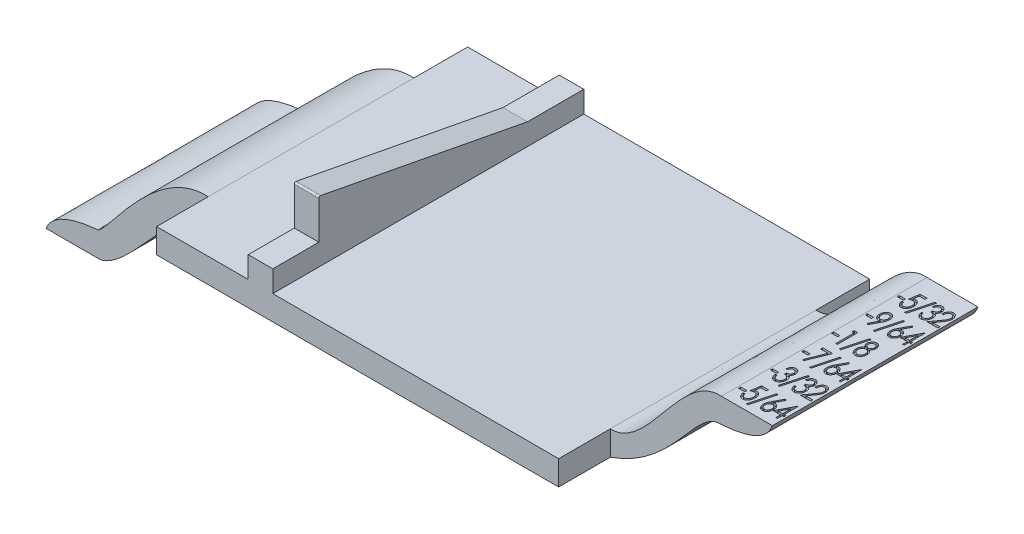
from build123d import *

# Parameters (mm, degrees)
BOSS_EXTRUDE1_DEPTH     = 30.4
CUT_EXTRUDE1_DEPTH      = 30.4
CUT_EXTRUDE2_DEPTH      = 30.4
CUT_EXTRUDE2_DEPTH_BACK = 30.4
BOSS_EXTRUDE2_DEPTH     = 25.35
CUT_EXTRUDE3_DEPTH      = 26
CUT_EXTRUDE3_DEPTH_BACK = 26
SKETCH6_W               = 15.859583535
SKETCH6_H               = 5.25
SKETCH6_W_2             = 15.836019773
SKETCH7_W               = 0.58974359
SKETCH7_H               = 0.205128205
SKETCH7_W_2             = 0.589743589
CUT_EXTRUDE4_DEPTH      = 0.25
SKETCH8_W               = 0.58974359
SKETCH8_H               = 0.205128205
CUT_EXTRUDE5_DEPTH      = 0.25


with BuildPart() as part:
    # Sketch1 → Boss-Extrude1 (new body)
    with BuildSketch(Plane.XY):
        Polygon((-19.65, 1.2), (-10.691407, 1.2), (-10.691407, 7.2), (-8.291407, 7.2), (-8.291407, 1.2), (19.65, 1.2), (19.65, -1.2), (1.1, -1.2), (1.1, -5), (-1.1, -5), (-1.1, -1.2), (-19.65, -1.2), align=None)
    extrude(amount=BOSS_EXTRUDE1_DEPTH)

    # Sketch3 → Cut-Extrude1 (cut)
    with BuildSketch(Plane(origin=(0, 0, 0), x_dir=(0, 0, -1), z_dir=(1, 0, 0))):
        with BuildLine():
            Line((-30.4, 3.3), (-25.9, 3.3))
            Line((-25.9, 3.3), (-25.9, 7.018606995))
            ThreePointArc((-25.9, 7.018606995), (-25.845590387, 7.134203179), (-25.721833629, 7.165938782))
            Line((-25.721833629, 7.165938782), (-5.5, 3.3))
            Line((-5.5, 3.3), (0, 3.3))
            Line((0, 3.3), (0, 7.2))
            Line((0, 7.2), (-30.4, 7.2))
            Line((-30.4, 7.2), (-30.4, 3.3))
        make_face()
    extrude(amount=-CUT_EXTRUDE1_DEPTH, mode=Mode.SUBTRACT)

    # Sketch4 → Cut-Extrude2 (cut, two sides: drawn at the far end of the back side and taken through both)
    with BuildSketch(Plane(origin=(0, 0, 0), x_dir=(0, 0, -1), z_dir=(1, 0, 0)).offset(-CUT_EXTRUDE2_DEPTH_BACK)):
        with BuildLine():
            Line((-4.6, -1.2), (-4.6, -3))
            Line((-4.6, -3), (-13.3, -3))
            Line((-13.3, -3), (-24.760620344, -3.905443195))
            ThreePointArc((-24.760620344, -3.905443195), (-25.139345084, -3.77420872), (-25.3, -3.406996365))
            Line((-25.3, -3.406996365), (-25.3, -1.2))
            Line((-25.3, -1.2), (-25.55, -1.2))
            Line((-25.55, -1.2), (-25.8, -1.2))
            Line((-25.8, -1.2), (-30.4, -1.2))
            Line((-30.4, -1.2), (-30.4, -5.00736076))
            Line((-30.4, -5.00736076), (-26.329480751, -5))
            Line((-26.329480751, -5), (-26.329480751, -5.375545601))
            Line((-26.329480751, -5.375545601), (-24.297950025, -5.375545601))
            Line((-24.297950025, -5.375545601), (-24.297950025, -5))
            Line((-24.297950025, -5), (0, -5))
            Line((0, -5), (0, -1.2))
            Line((0, -1.2), (-4.6, -1.2))
        make_face()
    extrude(amount=CUT_EXTRUDE2_DEPTH + CUT_EXTRUDE2_DEPTH_BACK, mode=Mode.SUBTRACT)

    # Sketch5 → Boss-Extrude2 (add)
    with BuildSketch(Plane.XY):
        with BuildLine():
            Line((-35.509583535, -9.408079162), (-30.484803333, -9.408079162))
            add(Edge.make_bspline(
                [(-30.484803333, -9.408079162), (-27.615408545, -9.535979205), (-22.404623245, -0.030767614), (-19.65, -1.2)],
                knots=[0, 0, 0, 0, 1, 1, 1, 1], degree=3))
            Line((-19.65, -1.2), (-19.65, 1.2))
            add(Edge.make_bspline(
                [(-30.484803333, -6.998469449), (-29.712130806, -7.129398198), (-24.961357021, 1.465917771), (-19.65, 1.2)],
                knots=[0, 0, 0, 0, 1, 1, 1, 1], degree=3))
            add(Edge.make_bspline(
                [(-30.484803333, -6.998469449), (-34.697910795, -7.394823438), (-35.509583535, -9.408079162)],
                knots=[0, 0, 0, 1, 1, 1], degree=2))
        make_face()
        with BuildLine():
            Line((30.505571933, 9.387855478), (35.486019773, 9.387855478))
            add(Edge.make_bspline(
                [(30.505571933, 6.993473977), (34.758266787, 7.279395339), (35.486019773, 9.387855478)],
                knots=[0, 0, 0, 1, 1, 1], degree=2))
            add(Edge.make_bspline(
                [(19.65, -1.2), (26.015958108, 0.989341349), (27.869550943, 7.15154374), (30.505571933, 6.993473977)],
                knots=[0, 0, 0, 0, 1, 1, 1, 1], degree=3))
            Line((19.65, -1.2), (19.65, 1.2))
            add(Edge.make_bspline(
                [(19.65, 1.2), (23.349090914, 1.036364636), (26.531962104, 9.646607131), (30.505571933, 9.387855478)],
                knots=[0, 0, 0, 0, 1, 1, 1, 1], degree=3))
        make_face()
    extrude(amount=BOSS_EXTRUDE2_DEPTH)

    # Sketch6 → Cut-Extrude3 (cut, two sides: drawn at the far end of the back side and taken through both)
    with BuildSketch(Plane(origin=(0, 0, 0), x_dir=(1, 0, 0), z_dir=(0, 1, 0)).offset(-CUT_EXTRUDE3_DEPTH_BACK)):
        with Locations((-27.579791768, -2.625)):
            Rectangle(SKETCH6_W, SKETCH6_H)
        with Locations((27.568009887, -2.625)):
            Rectangle(SKETCH6_W_2, SKETCH6_H)
    extrude(amount=CUT_EXTRUDE3_DEPTH + CUT_EXTRUDE3_DEPTH_BACK, mode=Mode.SUBTRACT)

    # Sketch7 → Cut-Extrude4 (cut)
    # profile 1 of 29: a face of its own
    with BuildSketch(Plane(origin=(0, 9.387855478, 0), x_dir=(1, 0, 0), z_dir=(0, 1, 0))):
        Polygon((35.087622776, -22.448717949), (35.118872776, -22.448717949), (35.118872776, -23.833333333), (35.298359956, -23.833333333), (35.298359956, -24.038461538), (35.118872776, -24.038461538), (35.118872776, -24.5), (34.965026622, -24.5), (34.965026622, -24.038461538), (34.247077904, -24.038461538), align=None)
        Polygon((34.965026622, -23.833333333), (34.965026622, -23.032451923), (34.541949699, -23.833333333), align=None, mode=Mode.SUBTRACT)
    # profile 2 of 29: a face of its own
    with BuildSketch(Plane(origin=(0, 9.387855478, 0), x_dir=(1, 0, 0), z_dir=(0, 1, 0))):
        with BuildLine():
            Line((33.890667648, -22.448717949), (34.014866366, -22.565705128))
            Line((34.014866366, -22.565705128), (33.586581109, -23.37099359))
            add(Edge.make_bspline(
                [(33.586581109, -23.37099359), (33.600431047, -23.367233395), (33.627552615, -23.359870013), (33.668043766, -23.351664699), (33.707608087, -23.347237212), (33.733606655, -23.346511823), (33.746436879, -23.346153846)],
                knots=[0, 0, 0, 0, 1.060929787, 2.077560185, 3.051281057, 4, 4, 4, 4], degree=3))
            add(Edge.make_bspline(
                [(33.746436879, -23.346153846), (33.761964879, -23.34670118), (33.792563421, -23.347779722), (33.837363938, -23.356083469), (33.880380654, -23.369285569), (33.921430235, -23.388438573), (33.960872967, -23.412549839), (33.998449221, -23.442199096), (34.034068223, -23.477200941), (34.067454063, -23.517157549), (34.098000355, -23.560857833), (34.125077501, -23.607387599), (34.14735311, -23.656680604), (34.166500044, -23.708080386), (34.180861902, -23.762304647), (34.190547412, -23.819047), (34.197406791, -23.878038948), (34.198038586, -23.91824874), (34.198359956, -23.938701923)],
                knots=[0, 0, 0, 0, 0.901205013, 1.775860311, 2.636794131, 3.507728647, 4.39883402, 5.315685146, 6.280851143, 7.293630634, 8.33489768, 9.373736179, 10.414743294, 11.472171862, 12.555667919, 13.666163363, 14.812866618, 16, 16, 16, 16], degree=3))
            add(Edge.make_bspline(
                [(34.198359956, -23.938701923), (34.197633455, -23.96666101), (34.196208199, -24.021511473), (34.18374931, -24.101509771), (34.164343673, -24.177715874), (34.136243621, -24.248960438), (34.101680452, -24.315041775), (34.059570478, -24.374163126), (34.010812592, -24.426211512), (33.956095241, -24.470585929), (33.896939723, -24.50634643), (33.834647489, -24.532398031), (33.769787602, -24.548207439), (33.725688648, -24.550254986), (33.703568289, -24.551282051)],
                knots=[0, 0, 0, 0, 1.1494067, 2.254919458, 3.322155787, 4.377964422, 5.397776209, 6.382466747, 7.354045797, 8.32263862, 9.271321606, 10.187430282, 11.090801708, 12, 12, 12, 12], degree=3))
            add(Edge.make_bspline(
                [(33.703568289, -24.551282051), (33.682110968, -24.550417499), (33.639602751, -24.548704769), (33.577226558, -24.533051757), (33.517496638, -24.507899156), (33.460514904, -24.47339634), (33.408025845, -24.429608134), (33.361218681, -24.377206232), (33.320162256, -24.317009881), (33.285666333, -24.24951437), (33.258388771, -24.176854088), (33.238732269, -24.100837726), (33.226225795, -24.022449005), (33.224747475, -23.969197586), (33.224000981, -23.942307692)],
                knots=[0, 0, 0, 0, 0.896664654, 1.776345551, 2.673079863, 3.600831316, 4.55320042, 5.522713429, 6.531813274, 7.594061508, 8.687030288, 9.772760072, 10.875330519, 12, 12, 12, 12], degree=3))
            add(Edge.make_bspline(
                [(33.224000981, -23.942307692), (33.224451293, -23.92171878), (33.225369489, -23.879737481), (33.233444902, -23.816152678), (33.245924312, -23.750996535), (33.263446167, -23.683331455), (33.287424045, -23.611489488), (33.319747233, -23.534088882), (33.358846087, -23.449445515), (33.389441168, -23.39168133), (33.405491366, -23.361378205)],
                knots=[0, 0, 0, 0, 0.803132881, 1.63760775, 2.497139017, 3.390748782, 4.363024246, 5.449780174, 6.662153211, 8, 8, 8, 8], degree=3))
            Line((33.405491366, -23.361378205), (33.890667648, -22.448717949))
        make_face()
        with BuildLine():
            add(Edge.make_bspline(
                [(33.711180468, -23.551282051), (33.699812287, -23.551723743), (33.677491196, -23.552590992), (33.644472648, -23.557786056), (33.612996579, -23.567168817), (33.582433431, -23.579534793), (33.5535596, -23.596260933), (33.525775513, -23.616261229), (33.499645148, -23.640363163), (33.47472808, -23.66717804), (33.451819751, -23.696671832), (33.432427293, -23.728464234), (33.415273093, -23.761379878), (33.401774155, -23.796109513), (33.390801338, -23.832229033), (33.383290106, -23.869936104), (33.378811732, -23.909213052), (33.378173416, -23.935885423), (33.377847135, -23.949519231)],
                knots=[0, 0, 0, 0, 0.946268867, 1.857971231, 2.772378949, 3.674274847, 4.595075925, 5.54206238, 6.517636006, 7.547827487, 8.585901374, 9.619025919, 10.642903972, 11.670634825, 12.714877187, 13.780659826, 14.865565546, 16, 16, 16, 16], degree=3))
            add(Edge.make_bspline(
                [(33.377847135, -23.949519231), (33.378169953, -23.963020366), (33.378801373, -23.989428113), (33.383341814, -24.028425687), (33.390722999, -24.065898958), (33.401875448, -24.101826372), (33.415156502, -24.136381449), (33.432549965, -24.169042272), (33.451802794, -24.200773298), (33.474734284, -24.230252223), (33.499637495, -24.257085647), (33.525798512, -24.281131655), (33.553425274, -24.301289559), (33.58265322, -24.317316215), (33.612878429, -24.33040538), (33.6444909, -24.339609045), (33.677486436, -24.344855544), (33.699810681, -24.345715744), (33.711180468, -24.346153846)],
                knots=[0, 0, 0, 0, 1.126413976, 2.203226288, 3.27193519, 4.308375719, 5.338928357, 6.355711774, 7.391672913, 8.432596984, 9.465617006, 10.443869212, 11.393455756, 12.311321693, 13.22000908, 14.136927438, 15.051133013, 16, 16, 16, 16], degree=3))
            add(Edge.make_bspline(
                [(33.711180468, -24.346153846), (33.722548367, -24.345710116), (33.744868903, -24.344838864), (33.777764469, -24.339692883), (33.809275964, -24.330212498), (33.839546963, -24.317539806), (33.86860973, -24.301165733), (33.8961707, -24.281005616), (33.922723438, -24.257354927), (33.94721326, -24.23010688), (33.970119445, -24.200674343), (33.989872323, -24.169162137), (34.007178941, -24.136366059), (34.020492394, -24.101830541), (34.03163602, -24.0658978), (34.039019645, -24.028426002), (34.043559426, -23.98942803), (34.044190937, -23.963020338), (34.044513802, -23.949519231)],
                knots=[0, 0, 0, 0, 0.949074805, 1.863480608, 2.76990316, 3.689052114, 4.597391575, 5.547186095, 6.533934344, 7.559637911, 8.600789962, 9.642896214, 10.659902324, 11.690680672, 12.727348199, 13.796291166, 14.87333932, 16, 16, 16, 16], degree=3))
            add(Edge.make_bspline(
                [(34.044513802, -23.949519231), (34.044187474, -23.935885452), (34.043549065, -23.909213137), (34.039071357, -23.869935786), (34.031557676, -23.832230194), (34.020593756, -23.796105302), (34.007062296, -23.761395305), (33.989996428, -23.728343544), (33.970102553, -23.696770745), (33.947219413, -23.667323422), (33.922715734, -23.640093857), (33.896194206, -23.616386742), (33.868474296, -23.596384017), (33.839767128, -23.579311554), (33.809159908, -23.567359243), (33.777782412, -23.557702666), (33.744864201, -23.552607606), (33.72254678, -23.551729349), (33.711180468, -23.551282051)],
                knots=[0, 0, 0, 0, 1.134674697, 2.21981017, 3.285818513, 4.330282017, 5.358230516, 6.382325399, 7.421570703, 8.459864426, 9.482752076, 10.466791355, 11.413978355, 12.325331643, 13.237701197, 14.141635301, 15.053530739, 16, 16, 16, 16], degree=3))
        make_face(mode=Mode.SUBTRACT)
    # profile 3 of 29: a face of its own
    with BuildSketch(Plane(origin=(0, 9.387855478, 0), x_dir=(1, 0, 0), z_dir=(0, 1, 0))):
        Polygon((33.149642007, -22.448717949), (32.51823175, -24.782051282), (32.354770212, -24.782051282), (32.986180468, -22.448717949), align=None)
    # profile 4 of 29: a face of its own
    with BuildSketch(Plane(origin=(0, 9.387855478, 0), x_dir=(1, 0, 0), z_dir=(0, 1, 0))):
        with BuildLine():
            Line((32.254770212, -22.5), (32.254770212, -22.705128205))
            Line((32.254770212, -22.705128205), (31.712702904, -22.705128205))
            Line((31.712702904, -22.705128205), (31.631773417, -23.232772436))
            add(Edge.make_bspline(
                [(31.631773417, -23.232772436), (31.648245753, -23.226628522), (31.680024491, -23.21477557), (31.727312138, -23.201981546), (31.772240232, -23.193713161), (31.801478937, -23.19276689), (31.815667648, -23.192307692)],
                knots=[0, 0, 0, 0, 1.113577535, 2.148334562, 3.101439487, 4, 4, 4, 4], degree=3))
            add(Edge.make_bspline(
                [(31.815667648, -23.192307692), (31.833070241, -23.192785668), (31.867307075, -23.19372601), (31.917447426, -23.203002406), (31.965363326, -23.217335575), (32.010899197, -23.237457975), (32.053938024, -23.263495234), (32.094415733, -23.295510649), (32.133170153, -23.332790672), (32.168386245, -23.376167493), (32.200651578, -23.423427923), (32.228928895, -23.474401766), (32.252840172, -23.52845333), (32.272782908, -23.585721181), (32.287281201, -23.646461424), (32.298009027, -23.710306998), (32.305182732, -23.777348313), (32.305758386, -23.823164747), (32.306052263, -23.846554487)],
                knots=[0, 0, 0, 0, 0.915452749, 1.801007638, 2.675239231, 3.544138018, 4.414827501, 5.316484203, 6.256349044, 7.24041834, 8.25264956, 9.266198822, 10.305020537, 11.361306631, 12.454513165, 13.588568039, 14.768940248, 16, 16, 16, 16], degree=3))
            add(Edge.make_bspline(
                [(32.306052263, -23.846554487), (32.305270156, -23.87892323), (32.303731033, -23.94262228), (32.289658718, -24.035918981), (32.267195258, -24.125195624), (32.236287941, -24.209458037), (32.19785752, -24.287063146), (32.15237267, -24.355716265), (32.100862619, -24.415361041), (32.051665337, -24.456096714), (32.010441596, -24.484546941), (31.977761352, -24.501814398), (31.944378408, -24.517452943), (31.909568062, -24.529655878), (31.873701798, -24.539450587), (31.836550544, -24.546063532), (31.798295861, -24.550818949), (31.772279951, -24.551126936), (31.759177263, -24.551282051)],
                knots=[0, 0, 0, 0, 1.560107059, 3.070163622, 4.538401596, 5.993174223, 7.390017185, 8.704628562, 9.955064718, 11.175437472, 11.773810098, 12.367450782, 12.955334644, 13.550126979, 14.143767662, 14.746284672, 15.368577114, 16, 16, 16, 16], degree=3))
            add(Edge.make_bspline(
                [(31.759177263, -24.551282051), (31.743515212, -24.550884921), (31.712666179, -24.550102707), (31.667599829, -24.541974702), (31.624181778, -24.530172154), (31.582837114, -24.51271521), (31.543117675, -24.490505571), (31.505615682, -24.463043059), (31.469525768, -24.431233028), (31.436226154, -24.394255019), (31.40510238, -24.353763627), (31.377457799, -24.309785295), (31.352831782, -24.263085862), (31.3317966, -24.213418849), (31.313606798, -24.160981516), (31.298829978, -24.1056993), (31.287592354, -24.047437707), (31.282834615, -24.007514545), (31.280411238, -23.987179487)],
                knots=[0, 0, 0, 0, 0.923275421, 1.818545566, 2.694317439, 3.573945876, 4.459590681, 5.373909434, 6.311768093, 7.29356341, 8.305513485, 9.322178447, 10.355055801, 11.417807359, 12.501966515, 13.627940912, 14.791780093, 16, 16, 16, 16], degree=3))
            Line((31.280411238, -23.987179487), (31.434257391, -23.987179487))
            add(Edge.make_bspline(
                [(31.434257391, -23.987179487), (31.437535645, -24.006212539), (31.443801632, -24.042591929), (31.458003591, -24.093919081), (31.475012413, -24.139785395), (31.495502907, -24.180543319), (31.520030434, -24.216156445), (31.547525741, -24.248310789), (31.578789268, -24.276849899), (31.613673025, -24.301055308), (31.650435548, -24.321264339), (31.689131158, -24.335214806), (31.728410199, -24.344637712), (31.755117874, -24.345650483), (31.768392007, -24.346153846)],
                knots=[0, 0, 0, 0, 1.295040219, 2.475313703, 3.5669374, 4.572676558, 5.526934895, 6.460829183, 7.40583148, 8.357815864, 9.30383694, 10.210915259, 11.110796898, 12, 12, 12, 12], degree=3))
            add(Edge.make_bspline(
                [(31.768392007, -24.346153846), (31.781378148, -24.345680435), (31.806997082, -24.344746494), (31.8445262, -24.337667049), (31.880703498, -24.326503981), (31.915120172, -24.310048689), (31.948932187, -24.290203916), (31.980289931, -24.264391476), (32.011142597, -24.235177399), (32.039510644, -24.201190902), (32.065843142, -24.164137329), (32.0893286, -24.124514518), (32.108308991, -24.082130256), (32.124587, -24.037904421), (32.136932269, -23.991344935), (32.145569424, -23.942554973), (32.151560523, -23.891574635), (32.151988023, -23.856722073), (32.152206109, -23.838942308)],
                knots=[0, 0, 0, 0, 0.883627968, 1.743212611, 2.591519239, 3.453888357, 4.334892888, 5.253609023, 6.211746337, 7.224577056, 8.261445484, 9.30467269, 10.354377667, 11.418591148, 12.510297713, 13.628489155, 14.790192039, 16, 16, 16, 16], degree=3))
            add(Edge.make_bspline(
                [(32.152206109, -23.838942308), (32.151913653, -23.822904065), (32.151341983, -23.791553816), (32.146435092, -23.745743935), (32.138510728, -23.702318221), (32.127260511, -23.661153986), (32.112775614, -23.622343018), (32.095670146, -23.585488775), (32.074664381, -23.551343737), (32.050587937, -23.51985032), (32.024428056, -23.490857944), (31.995430676, -23.465904416), (31.964094975, -23.444946339), (31.931023782, -23.427043973), (31.895302859, -23.414008936), (31.857778941, -23.404189492), (31.817968434, -23.398652661), (31.790710537, -23.397846927), (31.776805468, -23.397435897)],
                knots=[0, 0, 0, 0, 1.180781187, 2.308094721, 3.388266191, 4.428481563, 5.445995518, 6.435805344, 7.415746039, 8.391334499, 9.351887262, 10.286308742, 11.200059834, 12.123916071, 13.048190959, 13.992752428, 14.976043021, 16, 16, 16, 16], degree=3))
            add(Edge.make_bspline(
                [(31.776805468, -23.397435897), (31.76463771, -23.397758591), (31.739678761, -23.398420511), (31.701389301, -23.40357046), (31.661368878, -23.411563854), (31.619530704, -23.422965911), (31.575818717, -23.437458973), (31.530139176, -23.45520895), (31.482490083, -23.475932311), (31.450613368, -23.491838511), (31.434257391, -23.5)],
                knots=[0, 0, 0, 0, 0.80946005, 1.660394019, 2.566651373, 3.523765815, 4.543866754, 5.629776835, 6.783835928, 8, 8, 8, 8], degree=3))
            Line((31.434257391, -23.5), (31.588103545, -22.5))
            Line((31.588103545, -22.5), (32.254770212, -22.5))
        make_face()
    # profile 5 of 29: a face of its own
    with BuildSketch(Plane(origin=(0, 9.387855478, 0), x_dir=(1, 0, 0), z_dir=(0, 1, 0))):
        with Locations((30.96246252, -23.730769231)):
            Rectangle(SKETCH7_W, SKETCH7_H)
    # profile 6 of 29: a face of its own
    with BuildSketch(Plane(origin=(0, 9.387855478, 0), x_dir=(1, 0, 0), z_dir=(0, 1, 0))):
        with BuildLine():
            Line((34.452206109, -20.015384615), (34.298359956, -20.015384615))
            add(Edge.make_bspline(
                [(34.298359956, -20.015384615), (34.299234245, -19.991591831), (34.300948216, -19.944948076), (34.309016603, -19.876779349), (34.321587847, -19.811908892), (34.337707063, -19.750158201), (34.358795654, -19.691656804), (34.38382951, -19.636277099), (34.413779063, -19.584434222), (34.44717379, -19.535984397), (34.484115601, -19.492280838), (34.523440232, -19.453849594), (34.56504512, -19.421588264), (34.608516747, -19.394677632), (34.654569906, -19.374278642), (34.702513521, -19.359296504), (34.752608099, -19.350192667), (34.786703727, -19.349213683), (34.80396893, -19.348717949)],
                knots=[0, 0, 0, 0, 1.230938968, 2.413152432, 3.545534228, 4.646194523, 5.710096973, 6.757825356, 7.784954849, 8.802285045, 9.797142082, 10.739805952, 11.640550166, 12.51471503, 13.377261748, 14.237953852, 15.107742393, 16, 16, 16, 16], degree=3))
            add(Edge.make_bspline(
                [(34.80396893, -19.348717949), (34.821098432, -19.349230886), (34.854638207, -19.350235225), (34.903637149, -19.358896789), (34.949966459, -19.373055183), (34.994207156, -19.392259823), (35.035453273, -19.417811251), (35.074483616, -19.448560826), (35.110379563, -19.485367709), (35.143881397, -19.526849355), (35.173742665, -19.572154324), (35.200698469, -19.619572474), (35.222413732, -19.669590911), (35.241218445, -19.721235273), (35.254860993, -19.775142242), (35.26562923, -19.830730154), (35.271562965, -19.888518536), (35.272329863, -19.927765394), (35.27271893, -19.947676282)],
                knots=[0, 0, 0, 0, 0.970791036, 1.900820694, 2.811155721, 3.713104759, 4.62746283, 5.554713417, 6.523967267, 7.536371396, 8.573953811, 9.597848819, 10.625126949, 11.662294735, 12.711119546, 13.774578629, 14.87098949, 16, 16, 16, 16], degree=3))
            add(Edge.make_bspline(
                [(35.27271893, -19.947676282), (35.271878385, -19.975618841), (35.270214637, -20.030927429), (35.259084416, -20.11266994), (35.239059364, -20.191414288), (35.216540203, -20.255625014), (35.193447932, -20.307323122), (35.172430669, -20.349466987), (35.148005102, -20.395037924), (35.11996467, -20.444028856), (35.087714151, -20.495845356), (35.05246452, -20.551453337), (35.013182712, -20.610038009), (34.985632037, -20.650160629), (34.971436879, -20.670833333)],
                knots=[0, 0, 0, 0, 1.261295308, 2.496566726, 3.714418638, 4.923181138, 5.562775407, 6.269082218, 7.048469138, 7.896342504, 8.816478249, 9.803085009, 10.868065612, 12, 12, 12, 12], degree=3))
            Line((34.971436879, -20.670833333), (34.600443289, -21.194871795))
            Line((34.600443289, -21.194871795), (35.298359956, -21.194871795))
            Line((35.298359956, -21.194871795), (35.298359956, -21.4))
            Line((35.298359956, -21.4), (34.247077904, -21.4))
            Line((34.247077904, -21.4), (34.833215725, -20.572275641))
            add(Edge.make_bspline(
                [(34.833215725, -20.572275641), (34.847402427, -20.552532702), (34.87473439, -20.514496146), (34.913634393, -20.459321445), (34.948527966, -20.408053905), (34.979518552, -20.360635951), (35.006607693, -20.317208029), (35.03015511, -20.277836665), (35.0494093, -20.242278676), (35.069717149, -20.200173398), (35.089928516, -20.149379611), (35.106671276, -20.087423203), (35.117183582, -20.023891249), (35.118305961, -19.980970409), (35.118872776, -19.959294872)],
                knots=[0, 0, 0, 0, 1.270435754, 2.447609283, 3.527690499, 4.510998396, 5.407568431, 6.202286261, 6.907966757, 7.519751147, 8.644626464, 9.758603318, 10.86806791, 12, 12, 12, 12], degree=3))
            add(Edge.make_bspline(
                [(35.118872776, -19.959294872), (35.11854609, -19.945661088), (35.1179038, -19.918856044), (35.113401435, -19.8794734), (35.106165796, -19.841573863), (35.096212799, -19.804918785), (35.083041439, -19.769788305), (35.066769929, -19.736236747), (35.047909574, -19.70396993), (35.026153367, -19.673551256), (35.002268302, -19.645696607), (34.977101706, -19.62087386), (34.950060787, -19.600558704), (34.922162035, -19.583349822), (34.892743686, -19.569926869), (34.861806193, -19.560941932), (34.829701489, -19.555003197), (34.807868804, -19.554236402), (34.796757391, -19.553846154)],
                knots=[0, 0, 0, 0, 1.139723743, 2.240782617, 3.309378442, 4.363054426, 5.412403181, 6.441115648, 7.477073508, 8.533585136, 9.562963888, 10.542068071, 11.482200111, 12.384095142, 13.278564758, 14.175817422, 15.071610064, 16, 16, 16, 16], degree=3))
            add(Edge.make_bspline(
                [(34.796757391, -19.553846154), (34.785117043, -19.554251411), (34.762233218, -19.555048107), (34.728568014, -19.560760184), (34.696455329, -19.570429957), (34.66580137, -19.583749126), (34.63663408, -19.600668927), (34.609224713, -19.621858126), (34.583219522, -19.646738924), (34.558883107, -19.675240928), (34.536290949, -19.706830802), (34.516759446, -19.742033488), (34.499457782, -19.780040558), (34.485249233, -19.821338432), (34.472585716, -19.865379894), (34.463326042, -19.912730396), (34.455825554, -19.962978487), (34.453434575, -19.997597595), (34.452206109, -20.015384615)],
                knots=[0, 0, 0, 0, 0.874902799, 1.719976208, 2.558523857, 3.390373396, 4.227236487, 5.086679806, 5.988529925, 6.928309786, 7.90051169, 8.902983315, 9.949917, 11.035886031, 12.183280426, 13.392230902, 14.66014911, 16, 16, 16, 16], degree=3))
        make_face()
    # profile 7 of 29: a face of its own
    with BuildSketch(Plane(origin=(0, 9.387855478, 0), x_dir=(1, 0, 0), z_dir=(0, 1, 0))):
        with BuildLine():
            Line((33.377847135, -19.861538462), (33.224000981, -19.861538462))
            add(Edge.make_bspline(
                [(33.224000981, -19.861538462), (33.22791554, -19.841456976), (33.235530924, -19.802390454), (33.250456402, -19.745905161), (33.268041224, -19.69306918), (33.288029171, -19.643643121), (33.310456858, -19.597810497), (33.335404089, -19.555414102), (33.362871153, -19.516544063), (33.393153091, -19.481631777), (33.424973494, -19.450273832), (33.458837856, -19.42339111), (33.493810894, -19.400410433), (33.530038652, -19.381259992), (33.568035354, -19.366833727), (33.607384863, -19.356496663), (33.648179614, -19.349710086), (33.675896805, -19.349051687), (33.689946494, -19.348717949)],
                knots=[0, 0, 0, 0, 1.298810822, 2.526706579, 3.706552554, 4.832417968, 5.909420552, 6.943403841, 7.952790508, 8.926794818, 9.874230024, 10.785337495, 11.667291887, 12.528247791, 13.381780619, 14.241524704, 15.108638693, 16, 16, 16, 16], degree=3))
            add(Edge.make_bspline(
                [(33.689946494, -19.348717949), (33.710321402, -19.349531509), (33.750998714, -19.351155735), (33.810601836, -19.365335509), (33.867967557, -19.388220594), (33.922537368, -19.419424032), (33.973283, -19.458132232), (34.018615326, -19.503717869), (34.057197587, -19.556016315), (34.089464651, -19.613552043), (34.114806309, -19.6748585), (34.133310678, -19.738106073), (34.145148672, -19.802735634), (34.146432449, -19.846397246), (34.147077904, -19.868349359)],
                knots=[0, 0, 0, 0, 0.954678092, 1.905958926, 2.856352419, 3.843923821, 4.845012468, 5.841681364, 6.849003002, 7.883993958, 8.928702644, 9.95355834, 10.971093475, 12, 12, 12, 12], degree=3))
            add(Edge.make_bspline(
                [(34.147077904, -19.868349359), (34.146419954, -19.88947837), (34.145135606, -19.930723097), (34.136333601, -19.990989971), (34.121000128, -20.047820086), (34.099761096, -20.101400446), (34.072278765, -20.151682734), (34.038326941, -20.198093312), (33.99885066, -20.241739249), (33.968330611, -20.266951025), (33.952767007, -20.279807692)],
                knots=[0, 0, 0, 0, 1.073700974, 2.095909892, 3.087003771, 4.058689934, 5.018499937, 5.990517871, 6.975270772, 8, 8, 8, 8], degree=3))
            add(Edge.make_bspline(
                [(33.952767007, -20.279807692), (33.970069749, -20.290138135), (34.004728151, -20.310830613), (34.050892302, -20.350969529), (34.092819721, -20.397212526), (34.115759784, -20.432502469), (34.127446494, -20.450480769)],
                knots=[0, 0, 0, 0, 0.977439456, 1.95786826, 2.959645327, 4, 4, 4, 4], degree=3))
            add(Edge.make_bspline(
                [(34.127446494, -20.450480769), (34.135134, -20.463725212), (34.150532678, -20.490254869), (34.169816099, -20.531946531), (34.18700952, -20.574595944), (34.200485258, -20.618593646), (34.210877847, -20.663736834), (34.21862698, -20.710007695), (34.222970109, -20.757555292), (34.223655876, -20.789681949), (34.224000981, -20.805849359)],
                knots=[0, 0, 0, 0, 0.98502278, 1.973077847, 2.952988278, 3.942500021, 4.930667216, 5.932419888, 6.959511586, 8, 8, 8, 8], degree=3))
            add(Edge.make_bspline(
                [(34.224000981, -20.805849359), (34.223171185, -20.833814636), (34.221522049, -20.88939278), (34.207699014, -20.971728958), (34.185776195, -21.052101431), (34.154999536, -21.129292315), (34.117237048, -21.201394566), (34.071999697, -21.265785633), (34.020473908, -21.321743153), (33.96257142, -21.36822911), (33.899919077, -21.405719522), (33.832623744, -21.431523169), (33.761974076, -21.448601146), (33.713418372, -21.450378753), (33.688744571, -21.451282051)],
                knots=[0, 0, 0, 0, 1.07928879, 2.144976749, 3.214649999, 4.291014968, 5.347580392, 6.350532428, 7.321185456, 8.274756266, 9.208714849, 10.128051289, 11.048760748, 12, 12, 12, 12], degree=3))
            add(Edge.make_bspline(
                [(33.688744571, -21.451282051), (33.672164697, -21.450789268), (33.639530733, -21.449819329), (33.591498808, -21.443066219), (33.545767205, -21.430906627), (33.502146763, -21.414358924), (33.460539515, -21.393452563), (33.421103686, -21.367567645), (33.383680817, -21.337041149), (33.34889934, -21.301507651), (33.316237512, -21.261911103), (33.287165431, -21.217294414), (33.259984021, -21.168984252), (33.237254428, -21.115633886), (33.215969015, -21.058599573), (33.198810108, -20.996845639), (33.183702321, -20.930832214), (33.176452673, -20.885094492), (33.17271893, -20.861538462)],
                knots=[0, 0, 0, 0, 0.921939347, 1.814641893, 2.690064491, 3.547955545, 4.404817413, 5.274044264, 6.165974242, 7.08494775, 8.034876527, 9.01528958, 10.042431219, 11.113159329, 12.23617791, 13.425593059, 14.674118353, 16, 16, 16, 16], degree=3))
            Line((33.17271893, -20.861538462), (33.326565084, -20.861538462))
            add(Edge.make_bspline(
                [(33.326565084, -20.861538462), (33.330067911, -20.876921251), (33.336858082, -20.906740531), (33.348421219, -20.949700613), (33.361104218, -20.989338988), (33.375179218, -21.025581533), (33.390302561, -21.058583218), (33.406847991, -21.088166902), (33.423716483, -21.114973651), (33.436832155, -21.130499849), (33.443151622, -21.137980769)],
                knots=[0, 0, 0, 0, 1.249045841, 2.421254594, 3.521381967, 4.542447082, 5.498070718, 6.392599928, 7.225513447, 8, 8, 8, 8], degree=3))
            add(Edge.make_bspline(
                [(33.443151622, -21.137980769), (33.451392041, -21.14657997), (33.467649783, -21.163545562), (33.494782226, -21.185509689), (33.523157222, -21.204846335), (33.553996217, -21.219221178), (33.585796454, -21.231789045), (33.61965663, -21.239856619), (33.655040622, -21.245401272), (33.679240036, -21.245900112), (33.691549058, -21.246153846)],
                knots=[0, 0, 0, 0, 1.021758194, 2.015853853, 2.99232988, 3.961709084, 4.930816905, 5.923787385, 6.943935344, 8, 8, 8, 8], degree=3))
            add(Edge.make_bspline(
                [(33.691549058, -21.246153846), (33.705464717, -21.245800397), (33.732762744, -21.245107045), (33.772571049, -21.238732699), (33.810541872, -21.22954026), (33.845944119, -21.2150623), (33.879700062, -21.197554568), (33.910831893, -21.175154543), (33.940412924, -21.149556306), (33.966922497, -21.119711175), (33.991198903, -21.087771397), (34.011945144, -21.053741608), (34.030410511, -21.018929172), (34.044491231, -20.982190083), (34.056524147, -20.944449873), (34.064250033, -20.905058498), (34.069274166, -20.864474005), (34.069859032, -20.836981337), (34.070154827, -20.823076923)],
                knots=[0, 0, 0, 0, 1.052753104, 2.065161431, 3.046079688, 4.003635001, 4.95347229, 5.918472059, 6.900067512, 7.909391302, 8.93464338, 9.933531314, 10.923888177, 11.913367224, 12.907998769, 13.919295725, 14.947683975, 16, 16, 16, 16], degree=3))
            add(Edge.make_bspline(
                [(34.070154827, -20.823076923), (34.069540401, -20.804474333), (34.068320875, -20.767551509), (34.05848839, -20.713114052), (34.041919368, -20.660673062), (34.019060494, -20.610900914), (33.991448139, -20.564682429), (33.958925917, -20.523565313), (33.921163918, -20.489385253), (33.886269379, -20.465413383), (33.855257126, -20.449370585), (33.828859405, -20.438600489), (33.799260878, -20.429581891), (33.766947277, -20.421128114), (33.731624786, -20.414006777), (33.693394987, -20.40801636), (33.652095124, -20.403205338), (33.623449718, -20.401093543), (33.608616366, -20.4)],
                knots=[0, 0, 0, 0, 1.263283359, 2.507392117, 3.744200483, 4.990722196, 6.220019409, 7.394729747, 8.537900384, 9.667851799, 10.260335586, 10.9073491, 11.601801616, 12.361041346, 13.176028601, 14.048675881, 14.989552541, 16, 16, 16, 16], degree=3))
            Line((33.608616366, -20.4), (33.608616366, -20.194871795))
            add(Edge.make_bspline(
                [(33.608616366, -20.194871795), (33.627228997, -20.194449818), (33.663760533, -20.193621591), (33.716968729, -20.183625792), (33.767980332, -20.169777426), (33.815234522, -20.148533493), (33.858577241, -20.124046026), (33.895934085, -20.095178799), (33.927343545, -20.063588309), (33.951648236, -20.028043144), (33.969705674, -19.990237483), (33.98399763, -19.951081295), (33.991403312, -19.909759212), (33.992617498, -19.881728644), (33.99323175, -19.867548077)],
                knots=[0, 0, 0, 0, 1.184810064, 2.325460155, 3.441023828, 4.546570539, 5.618333039, 6.607640349, 7.546777916, 8.446464137, 9.337367589, 10.212388989, 11.095653826, 12, 12, 12, 12], degree=3))
            add(Edge.make_bspline(
                [(33.99323175, -19.867548077), (33.992316937, -19.846868967), (33.990523174, -19.806321423), (33.973752715, -19.747904626), (33.946520433, -19.693968659), (33.914815528, -19.654149458), (33.886135956, -19.624885963), (33.862265508, -19.606075263), (33.83733225, -19.58994961), (33.81113994, -19.576458023), (33.783205018, -19.566508867), (33.753934385, -19.559354633), (33.723206646, -19.554796131), (33.702248883, -19.554167233), (33.691549058, -19.553846154)],
                knots=[0, 0, 0, 0, 1.53314642, 3.006189538, 4.474682704, 5.994678234, 6.766289745, 7.514592154, 8.246539885, 8.969695538, 9.697733768, 10.443599241, 11.205391533, 12, 12, 12, 12], degree=3))
            add(Edge.make_bspline(
                [(33.691549058, -19.553846154), (33.674355701, -19.554622748), (33.640764503, -19.556140003), (33.592466756, -19.570198106), (33.547535441, -19.59195518), (33.513742614, -19.617922656), (33.488943589, -19.643280336), (33.471005844, -19.665603123), (33.453001411, -19.69039139), (33.437043894, -19.719109812), (33.420841737, -19.750240641), (33.405764923, -19.784603541), (33.39069436, -19.82171359), (33.382218127, -19.847988906), (33.377847135, -19.861538462)],
                knots=[0, 0, 0, 0, 1.301832108, 2.543429971, 3.785151881, 5.072109952, 5.752847774, 6.472947927, 7.243338808, 8.074138771, 8.96240038, 9.905878246, 10.920111224, 12, 12, 12, 12], degree=3))
        make_face()
    # profile 8 of 29: a face of its own
    with BuildSketch(Plane(origin=(0, 9.387855478, 0), x_dir=(1, 0, 0), z_dir=(0, 1, 0))):
        Polygon((33.149642007, -19.348717949), (32.51823175, -21.682051282), (32.354770212, -21.682051282), (32.986180468, -19.348717949), align=None)
    # profile 9 of 29: a face of its own
    with BuildSketch(Plane(origin=(0, 9.387855478, 0), x_dir=(1, 0, 0), z_dir=(0, 1, 0))):
        with BuildLine():
            Line((31.485539443, -19.861538462), (31.331693289, -19.861538462))
            add(Edge.make_bspline(
                [(31.331693289, -19.861538462), (31.335607848, -19.841456976), (31.343223231, -19.802390454), (31.35814871, -19.745905161), (31.375733531, -19.69306918), (31.395721478, -19.643643121), (31.418149166, -19.597810497), (31.443096397, -19.555414102), (31.47056346, -19.516544063), (31.500845399, -19.481631777), (31.532665802, -19.450273832), (31.566530163, -19.42339111), (31.601503202, -19.400410433), (31.63773096, -19.381259992), (31.675727662, -19.366833727), (31.715077171, -19.356496663), (31.755871922, -19.349710086), (31.783589113, -19.349051687), (31.797638802, -19.348717949)],
                knots=[0, 0, 0, 0, 1.298810822, 2.526706579, 3.706552554, 4.832417968, 5.909420552, 6.943403841, 7.952790508, 8.926794818, 9.874230024, 10.785337495, 11.667291887, 12.528247791, 13.381780619, 14.241524704, 15.108638693, 16, 16, 16, 16], degree=3))
            add(Edge.make_bspline(
                [(31.797638802, -19.348717949), (31.81801371, -19.349531509), (31.858691021, -19.351155735), (31.918294144, -19.365335509), (31.975659865, -19.388220594), (32.030229676, -19.419424032), (32.080975308, -19.458132232), (32.126307633, -19.503717869), (32.164889894, -19.556016315), (32.197156958, -19.613552043), (32.222498616, -19.6748585), (32.241002986, -19.738106073), (32.25284098, -19.802735634), (32.254124757, -19.846397246), (32.254770212, -19.868349359)],
                knots=[0, 0, 0, 0, 0.954678092, 1.905958926, 2.856352419, 3.843923821, 4.845012468, 5.841681364, 6.849003002, 7.883993958, 8.928702644, 9.95355834, 10.971093475, 12, 12, 12, 12], degree=3))
            add(Edge.make_bspline(
                [(32.254770212, -19.868349359), (32.254112261, -19.88947837), (32.252827914, -19.930723097), (32.244025908, -19.990989971), (32.228692436, -20.047820086), (32.207453404, -20.101400446), (32.179971073, -20.151682734), (32.146019248, -20.198093312), (32.106542967, -20.241739249), (32.076022919, -20.266951025), (32.060459315, -20.279807692)],
                knots=[0, 0, 0, 0, 1.073700974, 2.095909892, 3.087003771, 4.058689934, 5.018499937, 5.990517871, 6.975270772, 8, 8, 8, 8], degree=3))
            add(Edge.make_bspline(
                [(32.060459315, -20.279807692), (32.077762057, -20.290138135), (32.112420459, -20.310830613), (32.15858461, -20.350969529), (32.200512029, -20.397212526), (32.223452092, -20.432502469), (32.235138802, -20.450480769)],
                knots=[0, 0, 0, 0, 0.977439456, 1.95786826, 2.959645327, 4, 4, 4, 4], degree=3))
            add(Edge.make_bspline(
                [(32.235138802, -20.450480769), (32.242826308, -20.463725212), (32.258224986, -20.490254869), (32.277508407, -20.531946531), (32.294701828, -20.574595944), (32.308177565, -20.618593646), (32.318570154, -20.663736834), (32.326319287, -20.710007695), (32.330662417, -20.757555292), (32.331348184, -20.789681949), (32.331693289, -20.805849359)],
                knots=[0, 0, 0, 0, 0.98502278, 1.973077847, 2.952988278, 3.942500021, 4.930667216, 5.932419888, 6.959511586, 8, 8, 8, 8], degree=3))
            add(Edge.make_bspline(
                [(32.331693289, -20.805849359), (32.330863493, -20.833814636), (32.329214357, -20.88939278), (32.315391322, -20.971728958), (32.293468503, -21.052101431), (32.262691844, -21.129292315), (32.224929356, -21.201394566), (32.179692005, -21.265785633), (32.128166215, -21.321743153), (32.070263728, -21.36822911), (32.007611384, -21.405719522), (31.940316051, -21.431523169), (31.869666384, -21.448601146), (31.82111068, -21.450378753), (31.796436879, -21.451282051)],
                knots=[0, 0, 0, 0, 1.07928879, 2.144976749, 3.214649999, 4.291014968, 5.347580392, 6.350532428, 7.321185456, 8.274756266, 9.208714849, 10.128051289, 11.048760748, 12, 12, 12, 12], degree=3))
            add(Edge.make_bspline(
                [(31.796436879, -21.451282051), (31.779857004, -21.450789268), (31.747223041, -21.449819329), (31.699191116, -21.443066219), (31.653459512, -21.430906627), (31.60983907, -21.414358924), (31.568231823, -21.393452563), (31.528795994, -21.367567645), (31.491373125, -21.337041149), (31.456591647, -21.301507651), (31.423929819, -21.261911103), (31.394857738, -21.217294414), (31.367676329, -21.168984252), (31.344946735, -21.115633886), (31.323661323, -21.058599573), (31.306502416, -20.996845639), (31.291394628, -20.930832214), (31.284144981, -20.885094492), (31.280411238, -20.861538462)],
                knots=[0, 0, 0, 0, 0.921939347, 1.814641893, 2.690064491, 3.547955545, 4.404817413, 5.274044264, 6.165974242, 7.08494775, 8.034876527, 9.01528958, 10.042431219, 11.113159329, 12.23617791, 13.425593059, 14.674118353, 16, 16, 16, 16], degree=3))
            Line((31.280411238, -20.861538462), (31.434257391, -20.861538462))
            add(Edge.make_bspline(
                [(31.434257391, -20.861538462), (31.437760218, -20.876921251), (31.44455039, -20.906740531), (31.456113527, -20.949700613), (31.468796526, -20.989338988), (31.482871526, -21.025581533), (31.497994869, -21.058583218), (31.514540299, -21.088166902), (31.531408791, -21.114973651), (31.544524463, -21.130499849), (31.55084393, -21.137980769)],
                knots=[0, 0, 0, 0, 1.249045841, 2.421254594, 3.521381967, 4.542447082, 5.498070718, 6.392599928, 7.225513447, 8, 8, 8, 8], degree=3))
            add(Edge.make_bspline(
                [(31.55084393, -21.137980769), (31.559084349, -21.14657997), (31.575342091, -21.163545562), (31.602474533, -21.185509689), (31.630849529, -21.204846335), (31.661688525, -21.219221178), (31.693488761, -21.231789045), (31.727348938, -21.239856619), (31.76273293, -21.245401272), (31.786932344, -21.245900112), (31.799241366, -21.246153846)],
                knots=[0, 0, 0, 0, 1.021758194, 2.015853853, 2.99232988, 3.961709084, 4.930816905, 5.923787385, 6.943935344, 8, 8, 8, 8], degree=3))
            add(Edge.make_bspline(
                [(31.799241366, -21.246153846), (31.813157025, -21.245800397), (31.840455052, -21.245107045), (31.880263356, -21.238732699), (31.91823418, -21.22954026), (31.953636427, -21.2150623), (31.987392369, -21.197554568), (32.018524201, -21.175154543), (32.048105232, -21.149556306), (32.074614804, -21.119711175), (32.098891211, -21.087771397), (32.119637451, -21.053741608), (32.138102819, -21.018929172), (32.152183539, -20.982190083), (32.164216455, -20.944449873), (32.171942341, -20.905058498), (32.176966474, -20.864474005), (32.177551339, -20.836981337), (32.177847135, -20.823076923)],
                knots=[0, 0, 0, 0, 1.052753104, 2.065161431, 3.046079688, 4.003635001, 4.95347229, 5.918472059, 6.900067512, 7.909391302, 8.93464338, 9.933531314, 10.923888177, 11.913367224, 12.907998769, 13.919295725, 14.947683975, 16, 16, 16, 16], degree=3))
            add(Edge.make_bspline(
                [(32.177847135, -20.823076923), (32.177232709, -20.804474333), (32.176013182, -20.767551509), (32.166180697, -20.713114052), (32.149611676, -20.660673062), (32.126752802, -20.610900914), (32.099140447, -20.564682429), (32.066618225, -20.523565313), (32.028856226, -20.489385253), (31.993961686, -20.465413383), (31.962949434, -20.449370585), (31.936551712, -20.438600489), (31.906953185, -20.429581891), (31.874639584, -20.421128114), (31.839317094, -20.414006777), (31.801087294, -20.40801636), (31.759787432, -20.403205338), (31.731142026, -20.401093543), (31.716308673, -20.4)],
                knots=[0, 0, 0, 0, 1.263283359, 2.507392117, 3.744200483, 4.990722196, 6.220019409, 7.394729747, 8.537900384, 9.667851799, 10.260335586, 10.9073491, 11.601801616, 12.361041346, 13.176028601, 14.048675881, 14.989552541, 16, 16, 16, 16], degree=3))
            Line((31.716308673, -20.4), (31.716308673, -20.194871795))
            add(Edge.make_bspline(
                [(31.716308673, -20.194871795), (31.734921305, -20.194449818), (31.771452841, -20.193621591), (31.824661037, -20.183625792), (31.87567264, -20.169777426), (31.922926829, -20.148533493), (31.966269549, -20.124046026), (32.003626393, -20.095178799), (32.035035853, -20.063588309), (32.059340543, -20.028043144), (32.077397981, -19.990237483), (32.091689938, -19.951081295), (32.099095619, -19.909759212), (32.100309806, -19.881728644), (32.100924058, -19.867548077)],
                knots=[0, 0, 0, 0, 1.184810064, 2.325460155, 3.441023828, 4.546570539, 5.618333039, 6.607640349, 7.546777916, 8.446464137, 9.337367589, 10.212388989, 11.095653826, 12, 12, 12, 12], degree=3))
            add(Edge.make_bspline(
                [(32.100924058, -19.867548077), (32.100009245, -19.846868967), (32.098215481, -19.806321423), (32.081445022, -19.747904626), (32.05421274, -19.693968659), (32.022507835, -19.654149458), (31.993828264, -19.624885963), (31.969957816, -19.606075263), (31.945024557, -19.58994961), (31.918832248, -19.576458023), (31.890897326, -19.566508867), (31.861626692, -19.559354633), (31.830898954, -19.554796131), (31.809941191, -19.554167233), (31.799241366, -19.553846154)],
                knots=[0, 0, 0, 0, 1.53314642, 3.006189538, 4.474682704, 5.994678234, 6.766289745, 7.514592154, 8.246539885, 8.969695538, 9.697733768, 10.443599241, 11.205391533, 12, 12, 12, 12], degree=3))
            add(Edge.make_bspline(
                [(31.799241366, -19.553846154), (31.782048009, -19.554622748), (31.748456811, -19.556140003), (31.700159064, -19.570198106), (31.655227748, -19.59195518), (31.621434922, -19.617922656), (31.596635896, -19.643280336), (31.578698151, -19.665603123), (31.560693718, -19.69039139), (31.544736202, -19.719109812), (31.528534045, -19.750240641), (31.513457231, -19.784603541), (31.498386668, -19.82171359), (31.489910435, -19.847988906), (31.485539443, -19.861538462)],
                knots=[0, 0, 0, 0, 1.301832108, 2.543429971, 3.785151881, 5.072109952, 5.752847774, 6.472947927, 7.243338808, 8.074138771, 8.96240038, 9.905878246, 10.920111224, 12, 12, 12, 12], degree=3))
        make_face()
    # profile 10 of 29: a face of its own
    with BuildSketch(Plane(origin=(0, 9.387855478, 0), x_dir=(1, 0, 0), z_dir=(0, 1, 0))):
        with Locations((30.96246252, -20.630769231)):
            Rectangle(SKETCH7_W, SKETCH7_H)
    # profile 11 of 29: a face of its own
    with BuildSketch(Plane(origin=(0, 9.387855478, 0), x_dir=(1, 0, 0), z_dir=(0, 1, 0))):
        Polygon((35.087622776, -16.248717949), (35.118872776, -16.248717949), (35.118872776, -17.633333333), (35.298359956, -17.633333333), (35.298359956, -17.838461538), (35.118872776, -17.838461538), (35.118872776, -18.3), (34.965026622, -18.3), (34.965026622, -17.838461538), (34.247077904, -17.838461538), align=None)
        Polygon((34.965026622, -17.633333333), (34.965026622, -16.832451923), (34.541949699, -17.633333333), align=None, mode=Mode.SUBTRACT)
    # profile 12 of 29: a face of its own
    with BuildSketch(Plane(origin=(0, 9.387855478, 0), x_dir=(1, 0, 0), z_dir=(0, 1, 0))):
        with BuildLine():
            Line((33.890667648, -16.248717949), (34.014866366, -16.365705128))
            Line((34.014866366, -16.365705128), (33.586581109, -17.17099359))
            add(Edge.make_bspline(
                [(33.586581109, -17.17099359), (33.600431047, -17.167233395), (33.627552615, -17.159870013), (33.668043766, -17.151664699), (33.707608087, -17.147237212), (33.733606655, -17.146511823), (33.746436879, -17.146153846)],
                knots=[0, 0, 0, 0, 1.060929787, 2.077560185, 3.051281057, 4, 4, 4, 4], degree=3))
            add(Edge.make_bspline(
                [(33.746436879, -17.146153846), (33.761964879, -17.14670118), (33.792563421, -17.147779722), (33.837363938, -17.156083469), (33.880380654, -17.169285569), (33.921430235, -17.188438573), (33.960872967, -17.212549839), (33.998449221, -17.242199096), (34.034068223, -17.277200941), (34.067454063, -17.317157549), (34.098000355, -17.360857833), (34.125077501, -17.407387599), (34.14735311, -17.456680604), (34.166500044, -17.508080386), (34.180861902, -17.562304647), (34.190547412, -17.619047), (34.197406791, -17.678038948), (34.198038586, -17.71824874), (34.198359956, -17.738701923)],
                knots=[0, 0, 0, 0, 0.901205013, 1.775860311, 2.636794131, 3.507728647, 4.39883402, 5.315685146, 6.280851143, 7.293630634, 8.33489768, 9.373736179, 10.414743294, 11.472171862, 12.555667919, 13.666163363, 14.812866618, 16, 16, 16, 16], degree=3))
            add(Edge.make_bspline(
                [(34.198359956, -17.738701923), (34.197633455, -17.76666101), (34.196208199, -17.821511473), (34.18374931, -17.901509771), (34.164343673, -17.977715874), (34.136243621, -18.048960438), (34.101680452, -18.115041775), (34.059570478, -18.174163126), (34.010812592, -18.226211512), (33.956095241, -18.270585929), (33.896939723, -18.30634643), (33.834647489, -18.332398031), (33.769787602, -18.348207439), (33.725688648, -18.350254986), (33.703568289, -18.351282051)],
                knots=[0, 0, 0, 0, 1.1494067, 2.254919458, 3.322155787, 4.377964422, 5.397776209, 6.382466747, 7.354045797, 8.32263862, 9.271321606, 10.187430282, 11.090801708, 12, 12, 12, 12], degree=3))
            add(Edge.make_bspline(
                [(33.703568289, -18.351282051), (33.682110968, -18.350417499), (33.639602751, -18.348704769), (33.577226558, -18.333051757), (33.517496638, -18.307899156), (33.460514904, -18.27339634), (33.408025845, -18.229608134), (33.361218681, -18.177206232), (33.320162256, -18.117009881), (33.285666333, -18.04951437), (33.258388771, -17.976854088), (33.238732269, -17.900837726), (33.226225795, -17.822449005), (33.224747475, -17.769197586), (33.224000981, -17.742307692)],
                knots=[0, 0, 0, 0, 0.896664654, 1.776345551, 2.673079863, 3.600831316, 4.55320042, 5.522713429, 6.531813274, 7.594061508, 8.687030288, 9.772760072, 10.875330519, 12, 12, 12, 12], degree=3))
            add(Edge.make_bspline(
                [(33.224000981, -17.742307692), (33.224451293, -17.72171878), (33.225369489, -17.679737481), (33.233444902, -17.616152678), (33.245924312, -17.550996535), (33.263446167, -17.483331455), (33.287424045, -17.411489488), (33.319747233, -17.334088882), (33.358846087, -17.249445515), (33.389441168, -17.19168133), (33.405491366, -17.161378205)],
                knots=[0, 0, 0, 0, 0.803132881, 1.63760775, 2.497139017, 3.390748782, 4.363024246, 5.449780174, 6.662153211, 8, 8, 8, 8], degree=3))
            Line((33.405491366, -17.161378205), (33.890667648, -16.248717949))
        make_face()
        with BuildLine():
            add(Edge.make_bspline(
                [(33.711180468, -17.351282051), (33.699812287, -17.351723743), (33.677491196, -17.352590992), (33.644472648, -17.357786056), (33.612996579, -17.367168817), (33.582433431, -17.379534793), (33.5535596, -17.396260933), (33.525775513, -17.416261229), (33.499645148, -17.440363163), (33.47472808, -17.46717804), (33.451819751, -17.496671832), (33.432427293, -17.528464234), (33.415273093, -17.561379878), (33.401774155, -17.596109513), (33.390801338, -17.632229033), (33.383290106, -17.669936104), (33.378811732, -17.709213052), (33.378173416, -17.735885423), (33.377847135, -17.749519231)],
                knots=[0, 0, 0, 0, 0.946268867, 1.857971231, 2.772378949, 3.674274847, 4.595075925, 5.54206238, 6.517636006, 7.547827487, 8.585901374, 9.619025919, 10.642903972, 11.670634825, 12.714877187, 13.780659826, 14.865565546, 16, 16, 16, 16], degree=3))
            add(Edge.make_bspline(
                [(33.377847135, -17.749519231), (33.378169953, -17.763020366), (33.378801373, -17.789428113), (33.383341814, -17.828425687), (33.390722999, -17.865898958), (33.401875448, -17.901826372), (33.415156502, -17.936381449), (33.432549965, -17.969042272), (33.451802794, -18.000773298), (33.474734284, -18.030252223), (33.499637495, -18.057085647), (33.525798512, -18.081131655), (33.553425274, -18.101289559), (33.58265322, -18.117316215), (33.612878429, -18.13040538), (33.6444909, -18.139609045), (33.677486436, -18.144855544), (33.699810681, -18.145715744), (33.711180468, -18.146153846)],
                knots=[0, 0, 0, 0, 1.126413976, 2.203226288, 3.27193519, 4.308375719, 5.338928357, 6.355711774, 7.391672913, 8.432596984, 9.465617006, 10.443869212, 11.393455756, 12.311321693, 13.22000908, 14.136927438, 15.051133013, 16, 16, 16, 16], degree=3))
            add(Edge.make_bspline(
                [(33.711180468, -18.146153846), (33.722548367, -18.145710116), (33.744868903, -18.144838864), (33.777764469, -18.139692883), (33.809275964, -18.130212498), (33.839546963, -18.117539806), (33.86860973, -18.101165733), (33.8961707, -18.081005616), (33.922723438, -18.057354927), (33.94721326, -18.03010688), (33.970119445, -18.000674343), (33.989872323, -17.969162137), (34.007178941, -17.936366059), (34.020492394, -17.901830541), (34.03163602, -17.8658978), (34.039019645, -17.828426002), (34.043559426, -17.78942803), (34.044190937, -17.763020338), (34.044513802, -17.749519231)],
                knots=[0, 0, 0, 0, 0.949074805, 1.863480608, 2.76990316, 3.689052114, 4.597391575, 5.547186095, 6.533934344, 7.559637911, 8.600789962, 9.642896214, 10.659902324, 11.690680672, 12.727348199, 13.796291166, 14.87333932, 16, 16, 16, 16], degree=3))
            add(Edge.make_bspline(
                [(34.044513802, -17.749519231), (34.044187474, -17.735885452), (34.043549065, -17.709213137), (34.039071357, -17.669935786), (34.031557676, -17.632230194), (34.020593756, -17.596105302), (34.007062296, -17.561395305), (33.989996428, -17.528343544), (33.970102553, -17.496770745), (33.947219413, -17.467323422), (33.922715734, -17.440093857), (33.896194206, -17.416386742), (33.868474296, -17.396384017), (33.839767128, -17.379311554), (33.809159908, -17.367359243), (33.777782412, -17.357702666), (33.744864201, -17.352607606), (33.72254678, -17.351729349), (33.711180468, -17.351282051)],
                knots=[0, 0, 0, 0, 1.134674697, 2.21981017, 3.285818513, 4.330282017, 5.358230516, 6.382325399, 7.421570703, 8.459864426, 9.482752076, 10.466791355, 11.413978355, 12.325331643, 13.237701197, 14.141635301, 15.053530739, 16, 16, 16, 16], degree=3))
        make_face(mode=Mode.SUBTRACT)
    # profile 13 of 29: a face of its own
    with BuildSketch(Plane(origin=(0, 9.387855478, 0), x_dir=(1, 0, 0), z_dir=(0, 1, 0))):
        Polygon((33.149642007, -16.248717949), (32.51823175, -18.582051282), (32.354770212, -18.582051282), (32.986180468, -16.248717949), align=None)
    # profile 14 of 29: a face of its own
    with BuildSketch(Plane(origin=(0, 9.387855478, 0), x_dir=(1, 0, 0), z_dir=(0, 1, 0))):
        Polygon((31.357334315, -16.3), (32.331693289, -16.3), (31.511180468, -18.351282051), (31.373760597, -18.262740385), (32.076885597, -16.505128205), (31.357334315, -16.505128205), align=None)
    # profile 15 of 29: a face of its own
    with BuildSketch(Plane(origin=(0, 9.387855478, 0), x_dir=(1, 0, 0), z_dir=(0, 1, 0))):
        with Locations((30.96246252, -17.53076923)):
            Rectangle(SKETCH7_W, SKETCH7_H)
    # profile 16 of 29: a face of its own
    with BuildSketch(Plane(origin=(0, 9.387855478, 0), x_dir=(1, 0, 0), z_dir=(0, 1, 0))):
        with Locations((30.85172578, -14.530769231)):
            Rectangle(SKETCH7_W_2, SKETCH7_H)
    # profile 17 of 29: a face of its own
    with BuildSketch(Plane(origin=(0, 9.387855478, 0), x_dir=(1, 0, 0), z_dir=(0, 1, 0))):
        Polygon((31.488184113, -13.3), (31.785059113, -13.3), (31.785059113, -15.3), (31.631212959, -15.3), (31.631212959, -13.505128205), (31.400443728, -13.505128205), align=None)
    # profile 18 of 29: a face of its own
    with BuildSketch(Plane(origin=(0, 9.387855478, 0), x_dir=(1, 0, 0), z_dir=(0, 1, 0))):
        Polygon((33.038905267, -13.248717949), (32.40749501, -15.582051282), (32.244033472, -15.582051282), (32.875443728, -13.248717949), align=None)
    # profile 19 of 29: a face of its own
    with BuildSketch(Plane(origin=(0, 9.387855478, 0), x_dir=(1, 0, 0), z_dir=(0, 1, 0))):
        with BuildLine():
            add(Edge.make_bspline(
                [(33.815587959, -14.185817308), (33.840322894, -14.202888281), (33.888110471, -14.235869182), (33.95074098, -14.293022189), (34.003003079, -14.353439941), (34.04411521, -14.418258191), (34.075268432, -14.486837419), (34.097350138, -14.55969876), (34.11087223, -14.637104426), (34.112455658, -14.690302282), (34.113264241, -14.717467949)],
                knots=[0, 0, 0, 0, 1.128817125, 2.180860238, 3.177988592, 4.123737061, 5.056171269, 6.001159785, 6.979285454, 8, 8, 8, 8], degree=3))
            add(Edge.make_bspline(
                [(34.113264241, -14.717467949), (34.112814681, -14.73670839), (34.111926432, -14.774723974), (34.106814692, -14.830989859), (34.097564734, -14.885470111), (34.084612559, -14.938323619), (34.068403677, -14.989435476), (34.048082859, -15.038825467), (34.024230006, -15.08638179), (34.005582324, -15.116634537), (33.996277062, -15.131730769)],
                knots=[0, 0, 0, 0, 1.057772661, 2.089964817, 3.102547595, 4.092524029, 5.079228706, 6.047156722, 7.025523981, 8, 8, 8, 8], degree=3))
            add(Edge.make_bspline(
                [(33.996277062, -15.131730769), (33.983970188, -15.149122781), (33.959863088, -15.183190815), (33.917972768, -15.228251209), (33.872219916, -15.26660909), (33.822193443, -15.297513419), (33.76845346, -15.321741835), (33.710991358, -15.339141205), (33.649536377, -15.349127132), (33.607290882, -15.350551425), (33.58562001, -15.351282051)],
                knots=[0, 0, 0, 0, 1.048906327, 2.054631539, 3.021839926, 3.982309668, 4.942418687, 5.918716991, 6.932354415, 8, 8, 8, 8], degree=3))
            add(Edge.make_bspline(
                [(33.58562001, -15.351282051), (33.564758051, -15.350627446), (33.524176932, -15.349354094), (33.465084965, -15.340590252), (33.410141153, -15.32530674), (33.358801707, -15.304433599), (33.311648865, -15.276832058), (33.268224097, -15.243533615), (33.22878859, -15.204040503), (33.194182566, -15.158870694), (33.16332611, -15.110402138), (33.136383916, -15.060121486), (33.113491335, -15.008702928), (33.094484896, -14.956145279), (33.080119082, -14.902219685), (33.069747329, -14.847186553), (33.063004915, -14.790952742), (33.062324835, -14.753010642), (33.06198219, -14.733894231)],
                knots=[0, 0, 0, 0, 1.104708739, 2.14890257, 3.154370595, 4.118367704, 5.075413289, 6.038709714, 7.008861323, 8.021763411, 9.045837506, 10.048840199, 11.039777576, 12.024055369, 13.005330523, 13.991512021, 14.988061252, 16, 16, 16, 16], degree=3))
            add(Edge.make_bspline(
                [(33.06198219, -14.733894231), (33.062802204, -14.706199182), (33.064408476, -14.651949182), (33.077806348, -14.572738311), (33.100578675, -14.498088429), (33.126230244, -14.438959083), (33.151755099, -14.394134536), (33.174025442, -14.361584276), (33.198888271, -14.329713245), (33.227082275, -14.29912922), (33.257442319, -14.26888747), (33.291000958, -14.239971364), (33.327256607, -14.212021045), (33.353017651, -14.194628653), (33.366068728, -14.185817308)],
                knots=[0, 0, 0, 0, 1.517674003, 2.972871206, 4.388029641, 5.787820883, 6.496147795, 7.212975084, 7.948222945, 8.710108948, 9.49185787, 10.296315951, 11.136878426, 12, 12, 12, 12], degree=3))
            add(Edge.make_bspline(
                [(33.366068728, -14.185817308), (33.347915836, -14.173078238), (33.312263674, -14.14805879), (33.266254165, -14.102829639), (33.226198003, -14.054179758), (33.194336677, -14.000627554), (33.169451026, -13.944055472), (33.151728864, -13.885131441), (33.141029878, -13.824160934), (33.139618089, -13.782814973), (33.138905267, -13.761939103)],
                knots=[0, 0, 0, 0, 1.058972266, 2.079814596, 3.074322664, 4.065626078, 5.049411374, 6.023340544, 7.001970524, 8, 8, 8, 8], degree=3))
            add(Edge.make_bspline(
                [(33.138905267, -13.761939103), (33.139510598, -13.740643237), (33.140722785, -13.697997834), (33.153390605, -13.634728044), (33.171306426, -13.571826747), (33.198109735, -13.511100818), (33.230071798, -13.453252998), (33.26943164, -13.40155709), (33.314216959, -13.3562041), (33.364263315, -13.317880133), (33.418104245, -13.286701151), (33.475282681, -13.265179955), (33.534332152, -13.251168327), (33.574590686, -13.249537841), (33.594834754, -13.248717949)],
                knots=[0, 0, 0, 0, 1.006801535, 2.016140496, 3.04434944, 4.097767983, 5.150882958, 6.16620321, 7.163091172, 8.159497914, 9.142029795, 10.096562843, 11.042853592, 12, 12, 12, 12], degree=3))
            add(Edge.make_bspline(
                [(33.594834754, -13.248717949), (33.614672078, -13.249552613), (33.653995966, -13.251207183), (33.711699775, -13.264905829), (33.766635287, -13.287744935), (33.818709117, -13.318789202), (33.867254478, -13.357042221), (33.910132559, -13.402927178), (33.948288778, -13.454431597), (33.979359407, -13.512007526), (34.004550554, -13.573134181), (34.023102741, -13.636468018), (34.034281672, -13.701580344), (34.03565189, -13.745469894), (34.036341164, -13.767548077)],
                knots=[0, 0, 0, 0, 0.945268751, 1.87382339, 2.810620796, 3.772987939, 4.756784404, 5.747996242, 6.759505551, 7.805656055, 8.859553138, 9.907698875, 10.947489625, 12, 12, 12, 12], degree=3))
            add(Edge.make_bspline(
                [(34.036341164, -13.767548077), (34.035594996, -13.789215446), (34.034135867, -13.831585897), (34.024274655, -13.893510194), (34.006295766, -13.951495016), (33.982201297, -14.006097602), (33.95124002, -14.057144207), (33.912283873, -14.10375548), (33.867662304, -14.147944832), (33.833174087, -14.17302732), (33.815587959, -14.185817308)],
                knots=[0, 0, 0, 0, 1.053501153, 2.060117211, 3.037794984, 3.997036466, 4.955838333, 5.929389179, 6.944160328, 8, 8, 8, 8], degree=3))
        make_face()
        with BuildLine():
            add(Edge.make_bspline(
                [(33.587222574, -13.453846154), (33.576796583, -13.454215377), (33.556402459, -13.45493761), (33.526388972, -13.458807566), (33.497860251, -13.466223538), (33.470400546, -13.476011227), (33.444786307, -13.489649464), (33.419988748, -13.505074972), (33.397177407, -13.524276888), (33.368730252, -13.55268082), (33.338308502, -13.592585858), (33.311835128, -13.645988776), (33.295547716, -13.703968688), (33.293696429, -13.744204707), (33.292751421, -13.76474359)],
                knots=[0, 0, 0, 0, 0.787074358, 1.539584277, 2.277719126, 3.007830531, 3.733477235, 4.463101644, 5.207606632, 5.977196966, 7.494883027, 8.968605234, 10.452593816, 12, 12, 12, 12], degree=3))
            add(Edge.make_bspline(
                [(33.292751421, -13.76474359), (33.293803057, -13.785296997), (33.29589457, -13.826173963), (33.3137021, -13.885708781), (33.342118288, -13.942168453), (33.374811326, -13.985099599), (33.404629752, -14.016816331), (33.428596779, -14.037718602), (33.453823064, -14.055143809), (33.479717306, -14.069516468), (33.506508172, -14.081033276), (33.53424176, -14.088956802), (33.563000794, -14.093997696), (33.582527275, -14.094577649), (33.592430908, -14.094871795)],
                knots=[0, 0, 0, 0, 1.503377697, 2.989943038, 4.512810598, 6.113657223, 6.923460787, 7.700377033, 8.438683534, 9.16575144, 9.867283722, 10.570247634, 11.274844133, 12, 12, 12, 12], degree=3))
            add(Edge.make_bspline(
                [(33.592430908, -14.094871795), (33.605037909, -14.09436701), (33.630296527, -14.093355653), (33.667422237, -14.084018681), (33.703447558, -14.069495051), (33.737883295, -14.049266345), (33.770222309, -14.024355605), (33.798772614, -13.994260651), (33.823901794, -13.960271157), (33.844820203, -13.922477617), (33.861291596, -13.882588074), (33.87357123, -13.84210039), (33.881073361, -13.801481433), (33.882023324, -13.774255651), (33.88249501, -13.760737179)],
                knots=[0, 0, 0, 0, 0.926959826, 1.857200198, 2.801319747, 3.77959719, 4.788725481, 5.797230661, 6.823935113, 7.893723746, 8.969417254, 9.996121706, 11.005010385, 12, 12, 12, 12], degree=3))
            add(Edge.make_bspline(
                [(33.88249501, -13.760737179), (33.881555272, -13.741954551), (33.879689289, -13.704659025), (33.865080126, -13.650055335), (33.840845544, -13.598092653), (33.813622372, -13.557458161), (33.787289413, -13.527695882), (33.765059621, -13.507790932), (33.74063632, -13.491089312), (33.714142579, -13.477000908), (33.685268345, -13.466984407), (33.65448556, -13.4591004), (33.621529136, -13.454836795), (33.598852044, -13.454181968), (33.587222574, -13.453846154)],
                knots=[0, 0, 0, 0, 1.41789026, 2.815418751, 4.237647105, 5.734964885, 6.492513555, 7.235814941, 7.983146572, 8.723359292, 9.495815479, 10.286317727, 11.121174114, 12, 12, 12, 12], degree=3))
        make_face(mode=Mode.SUBTRACT)
        with BuildLine():
            add(Edge.make_bspline(
                [(33.595636036, -14.3), (33.582380961, -14.300312425), (33.556375494, -14.300925379), (33.518332513, -14.307929668), (33.481709115, -14.317507167), (33.44682533, -14.332353543), (33.413573344, -14.35110473), (33.382118222, -14.374403294), (33.351967354, -14.401138375), (33.324245937, -14.432023045), (33.298850296, -14.465211561), (33.276662564, -14.50037549), (33.257748212, -14.536777694), (33.24250068, -14.574791329), (33.230361886, -14.614021852), (33.222099268, -14.654830979), (33.216613644, -14.69688523), (33.216091958, -14.725463098), (33.215828344, -14.739903846)],
                knots=[0, 0, 0, 0, 0.9847572, 1.932020036, 2.869543467, 3.795734653, 4.743309996, 5.703045184, 6.702129772, 7.735926045, 8.785026717, 9.807544264, 10.825030468, 11.832280622, 12.85044557, 13.875276944, 14.92635129, 16, 16, 16, 16], degree=3))
            add(Edge.make_bspline(
                [(33.215828344, -14.739903846), (33.21630366, -14.757841523), (33.217242533, -14.79327303), (33.226706301, -14.845607866), (33.240780221, -14.896563457), (33.261425259, -14.945224862), (33.286355828, -14.990801436), (33.31752572, -15.030808223), (33.35225721, -15.066242808), (33.392390608, -15.095063988), (33.436129213, -15.118207444), (33.483692556, -15.133983635), (33.534269714, -15.144602871), (33.569270132, -15.145628024), (33.587222574, -15.146153846)],
                knots=[0, 0, 0, 0, 1.046503232, 2.067112015, 3.096621624, 4.12790218, 5.147527128, 6.120914979, 7.080488514, 8.035200521, 8.994520469, 9.958867953, 10.953060937, 12, 12, 12, 12], degree=3))
            add(Edge.make_bspline(
                [(33.587222574, -15.146153846), (33.601135605, -15.145794), (33.628296373, -15.145091515), (33.667918647, -15.138868333), (33.70535509, -15.129016604), (33.740435766, -15.114697148), (33.77377087, -15.097123828), (33.804463694, -15.074849723), (33.833428335, -15.049098911), (33.85887951, -15.018910424), (33.882580696, -14.986794432), (33.902831141, -14.952526382), (33.920795824, -14.91739794), (33.934564599, -14.880579571), (33.946215174, -14.842829119), (33.953404229, -14.803410602), (33.95858359, -14.762743835), (33.959136919, -14.735113666), (33.959418087, -14.721073718)],
                knots=[0, 0, 0, 0, 1.057208993, 2.063864431, 3.041686247, 3.993867019, 4.938765438, 5.899569259, 6.870141775, 7.877872017, 8.895376391, 9.901878192, 10.900874436, 11.890851383, 12.886746751, 13.900342611, 14.933083623, 16, 16, 16, 16], degree=3))
            add(Edge.make_bspline(
                [(33.959418087, -14.721073718), (33.959173721, -14.707430209), (33.958692696, -14.680573555), (33.952963754, -14.640985922), (33.945300062, -14.602401905), (33.933561008, -14.564963299), (33.918209344, -14.528841973), (33.899716404, -14.493856469), (33.877973144, -14.460102975), (33.853318565, -14.427952186), (33.826500562, -14.398065659), (33.797567863, -14.371965848), (33.76740973, -14.349738823), (33.735897187, -14.331451633), (33.702799181, -14.317313893), (33.668214852, -14.30736074), (33.632319794, -14.30111602), (33.60794772, -14.300374555), (33.595636036, -14.3)],
                knots=[0, 0, 0, 0, 1.062772706, 2.092021773, 3.112970097, 4.127207538, 5.144326494, 6.168931198, 7.208606358, 8.270613836, 9.324630021, 10.334529776, 11.302840154, 12.240380969, 13.168626316, 14.101066092, 15.040743392, 16, 16, 16, 16], degree=3))
        make_face(mode=Mode.SUBTRACT)
    # profile 20 of 29: a face of its own
    with BuildSketch(Plane(origin=(0, 9.387855478, 0), x_dir=(1, 0, 0), z_dir=(0, 1, 0))):
        Polygon((35.087622776, -10.048717949), (35.118872776, -10.048717949), (35.118872776, -11.433333333), (35.298359956, -11.433333333), (35.298359956, -11.638461538), (35.118872776, -11.638461538), (35.118872776, -12.1), (34.965026622, -12.1), (34.965026622, -11.638461538), (34.247077904, -11.638461538), align=None)
        Polygon((34.965026622, -11.433333333), (34.965026622, -10.632451923), (34.541949699, -11.433333333), align=None, mode=Mode.SUBTRACT)
    # profile 21 of 29: a face of its own
    with BuildSketch(Plane(origin=(0, 9.387855478, 0), x_dir=(1, 0, 0), z_dir=(0, 1, 0))):
        with BuildLine():
            Line((33.890667648, -10.048717949), (34.014866366, -10.165705128))
            Line((34.014866366, -10.165705128), (33.586581109, -10.97099359))
            add(Edge.make_bspline(
                [(33.586581109, -10.97099359), (33.600431047, -10.967233395), (33.627552615, -10.959870013), (33.668043766, -10.951664699), (33.707608087, -10.947237212), (33.733606655, -10.946511823), (33.746436879, -10.946153846)],
                knots=[0, 0, 0, 0, 1.060929787, 2.077560185, 3.051281057, 4, 4, 4, 4], degree=3))
            add(Edge.make_bspline(
                [(33.746436879, -10.946153846), (33.761964879, -10.94670118), (33.792563421, -10.947779722), (33.837363938, -10.956083469), (33.880380654, -10.969285569), (33.921430235, -10.988438573), (33.960872967, -11.012549839), (33.998449221, -11.042199096), (34.034068223, -11.077200941), (34.067454063, -11.117157549), (34.098000355, -11.160857833), (34.125077501, -11.207387599), (34.14735311, -11.256680604), (34.166500044, -11.308080386), (34.180861902, -11.362304647), (34.190547412, -11.419047), (34.197406791, -11.478038948), (34.198038586, -11.51824874), (34.198359956, -11.538701923)],
                knots=[0, 0, 0, 0, 0.901205013, 1.775860311, 2.636794131, 3.507728647, 4.39883402, 5.315685146, 6.280851143, 7.293630634, 8.33489768, 9.373736179, 10.414743294, 11.472171862, 12.555667919, 13.666163363, 14.812866618, 16, 16, 16, 16], degree=3))
            add(Edge.make_bspline(
                [(34.198359956, -11.538701923), (34.197633455, -11.56666101), (34.196208199, -11.621511473), (34.18374931, -11.701509771), (34.164343673, -11.777715874), (34.136243621, -11.848960438), (34.101680452, -11.915041775), (34.059570478, -11.974163126), (34.010812592, -12.026211512), (33.956095241, -12.070585929), (33.896939723, -12.10634643), (33.834647489, -12.132398031), (33.769787602, -12.148207439), (33.725688648, -12.150254986), (33.703568289, -12.151282051)],
                knots=[0, 0, 0, 0, 1.1494067, 2.254919458, 3.322155787, 4.377964422, 5.397776209, 6.382466747, 7.354045797, 8.32263862, 9.271321606, 10.187430282, 11.090801708, 12, 12, 12, 12], degree=3))
            add(Edge.make_bspline(
                [(33.703568289, -12.151282051), (33.682110968, -12.150417499), (33.639602751, -12.148704769), (33.577226558, -12.133051757), (33.517496638, -12.107899156), (33.460514904, -12.07339634), (33.408025845, -12.029608134), (33.361218681, -11.977206232), (33.320162256, -11.917009881), (33.285666333, -11.84951437), (33.258388771, -11.776854088), (33.238732269, -11.700837726), (33.226225795, -11.622449005), (33.224747475, -11.569197586), (33.224000981, -11.542307692)],
                knots=[0, 0, 0, 0, 0.896664654, 1.776345551, 2.673079863, 3.600831316, 4.55320042, 5.522713429, 6.531813274, 7.594061508, 8.687030288, 9.772760072, 10.875330519, 12, 12, 12, 12], degree=3))
            add(Edge.make_bspline(
                [(33.224000981, -11.542307692), (33.224451293, -11.52171878), (33.225369489, -11.479737481), (33.233444902, -11.416152678), (33.245924312, -11.350996535), (33.263446167, -11.283331455), (33.287424045, -11.211489488), (33.319747233, -11.134088882), (33.358846087, -11.049445515), (33.389441168, -10.99168133), (33.405491366, -10.961378205)],
                knots=[0, 0, 0, 0, 0.803132881, 1.63760775, 2.497139017, 3.390748782, 4.363024246, 5.449780174, 6.662153211, 8, 8, 8, 8], degree=3))
            Line((33.405491366, -10.961378205), (33.890667648, -10.048717949))
        make_face()
        with BuildLine():
            add(Edge.make_bspline(
                [(33.711180468, -11.151282051), (33.699812287, -11.151723743), (33.677491196, -11.152590992), (33.644472648, -11.157786056), (33.612996579, -11.167168817), (33.582433431, -11.179534793), (33.5535596, -11.196260933), (33.525775513, -11.216261229), (33.499645148, -11.240363163), (33.47472808, -11.26717804), (33.451819751, -11.296671832), (33.432427293, -11.328464234), (33.415273093, -11.361379878), (33.401774155, -11.396109513), (33.390801338, -11.432229033), (33.383290106, -11.469936104), (33.378811732, -11.509213052), (33.378173416, -11.535885423), (33.377847135, -11.549519231)],
                knots=[0, 0, 0, 0, 0.946268867, 1.857971231, 2.772378949, 3.674274847, 4.595075925, 5.54206238, 6.517636006, 7.547827487, 8.585901374, 9.619025919, 10.642903972, 11.670634825, 12.714877187, 13.780659826, 14.865565546, 16, 16, 16, 16], degree=3))
            add(Edge.make_bspline(
                [(33.377847135, -11.549519231), (33.378169953, -11.563020366), (33.378801373, -11.589428113), (33.383341814, -11.628425687), (33.390722999, -11.665898958), (33.401875448, -11.701826372), (33.415156502, -11.736381449), (33.432549965, -11.769042272), (33.451802794, -11.800773298), (33.474734284, -11.830252223), (33.499637495, -11.857085647), (33.525798512, -11.881131655), (33.553425274, -11.901289559), (33.58265322, -11.917316215), (33.612878429, -11.93040538), (33.6444909, -11.939609045), (33.677486436, -11.944855544), (33.699810681, -11.945715744), (33.711180468, -11.946153846)],
                knots=[0, 0, 0, 0, 1.126413976, 2.203226288, 3.27193519, 4.308375719, 5.338928357, 6.355711774, 7.391672913, 8.432596984, 9.465617006, 10.443869212, 11.393455756, 12.311321693, 13.22000908, 14.136927438, 15.051133013, 16, 16, 16, 16], degree=3))
            add(Edge.make_bspline(
                [(33.711180468, -11.946153846), (33.722548367, -11.945710116), (33.744868903, -11.944838864), (33.777764469, -11.939692883), (33.809275964, -11.930212498), (33.839546963, -11.917539806), (33.86860973, -11.901165733), (33.8961707, -11.881005616), (33.922723438, -11.857354927), (33.94721326, -11.83010688), (33.970119445, -11.800674343), (33.989872323, -11.769162137), (34.007178941, -11.736366059), (34.020492394, -11.701830541), (34.03163602, -11.6658978), (34.039019645, -11.628426002), (34.043559426, -11.58942803), (34.044190937, -11.563020338), (34.044513802, -11.549519231)],
                knots=[0, 0, 0, 0, 0.949074805, 1.863480608, 2.76990316, 3.689052114, 4.597391575, 5.547186095, 6.533934344, 7.559637911, 8.600789962, 9.642896214, 10.659902324, 11.690680672, 12.727348199, 13.796291166, 14.87333932, 16, 16, 16, 16], degree=3))
            add(Edge.make_bspline(
                [(34.044513802, -11.549519231), (34.044187474, -11.535885452), (34.043549065, -11.509213137), (34.039071357, -11.469935786), (34.031557676, -11.432230194), (34.020593756, -11.396105302), (34.007062296, -11.361395305), (33.989996428, -11.328343544), (33.970102553, -11.296770745), (33.947219413, -11.267323422), (33.922715734, -11.240093857), (33.896194206, -11.216386742), (33.868474296, -11.196384017), (33.839767128, -11.179311554), (33.809159908, -11.167359243), (33.777782412, -11.157702666), (33.744864201, -11.152607606), (33.72254678, -11.151729349), (33.711180468, -11.151282051)],
                knots=[0, 0, 0, 0, 1.134674697, 2.21981017, 3.285818513, 4.330282017, 5.358230516, 6.382325399, 7.421570703, 8.459864426, 9.482752076, 10.466791355, 11.413978355, 12.325331643, 13.237701197, 14.141635301, 15.053530739, 16, 16, 16, 16], degree=3))
        make_face(mode=Mode.SUBTRACT)
    # profile 22 of 29: a face of its own
    with BuildSketch(Plane(origin=(0, 9.387855478, 0), x_dir=(1, 0, 0), z_dir=(0, 1, 0))):
        Polygon((33.149642007, -10.048717949), (32.51823175, -12.382051282), (32.354770212, -12.382051282), (32.986180468, -10.048717949), align=None)
    # profile 23 of 29: a face of its own
    with BuildSketch(Plane(origin=(0, 9.387855478, 0), x_dir=(1, 0, 0), z_dir=(0, 1, 0))):
        with BuildLine():
            Line((31.588103545, -12.151282051), (31.458696494, -12.044310897))
            Line((31.458696494, -12.044310897), (31.896597135, -11.231410256))
            add(Edge.make_bspline(
                [(31.896597135, -11.231410256), (31.882737656, -11.234744472), (31.85555653, -11.241283514), (31.814954013, -11.248733366), (31.775280214, -11.252658962), (31.749168338, -11.253455064), (31.736340725, -11.253846154)],
                knots=[0, 0, 0, 0, 1.054385792, 2.067855119, 3.050822456, 4, 4, 4, 4], degree=3))
            add(Edge.make_bspline(
                [(31.736340725, -11.253846154), (31.720679498, -11.253298713), (31.689816358, -11.252219887), (31.644618279, -11.243916815), (31.60120362, -11.230718551), (31.559753578, -11.211568454), (31.519910278, -11.187460444), (31.481932827, -11.157814576), (31.445900815, -11.122819224), (31.412157328, -11.082837338), (31.381087967, -11.039280901), (31.35425346, -10.992476855), (31.331106271, -10.943421905), (31.31295063, -10.891633298), (31.298317116, -10.837554246), (31.288108879, -10.78099359), (31.281395419, -10.721956583), (31.280743065, -10.681749753), (31.280411238, -10.661298077)],
                knots=[0, 0, 0, 0, 0.905584007, 1.784609035, 2.649738534, 3.524474779, 4.418882608, 5.338432457, 6.305568634, 7.319588827, 8.361454429, 9.396450544, 10.436854078, 11.49500759, 12.567032593, 13.674795596, 14.817257505, 16, 16, 16, 16], degree=3))
            add(Edge.make_bspline(
                [(31.280411238, -10.661298077), (31.281130193, -10.633338365), (31.28253725, -10.578618802), (31.29505691, -10.498758125), (31.314399547, -10.42299767), (31.342136249, -10.351841283), (31.377179428, -10.286280178), (31.419153093, -10.227003445), (31.46808466, -10.175002669), (31.522641075, -10.130211201), (31.581820941, -10.094092737), (31.643806471, -10.067669931), (31.708304563, -10.05176228), (31.752012668, -10.049736874), (31.774000981, -10.048717949)],
                knots=[0, 0, 0, 0, 1.151595438, 2.25377142, 3.323040016, 4.368603816, 5.392948313, 6.379513932, 7.352943095, 8.326854465, 9.280191963, 10.200171293, 11.094557005, 12, 12, 12, 12], degree=3))
            add(Edge.make_bspline(
                [(31.774000981, -10.048717949), (31.795585242, -10.049761344), (31.838333962, -10.05182784), (31.901105772, -10.067183815), (31.961007111, -10.092896879), (32.017919709, -10.128370299), (32.070631813, -10.172667928), (32.117640289, -10.225683239), (32.158727112, -10.286510235), (32.192308328, -10.354922958), (32.220709488, -10.427657382), (32.239868994, -10.504155442), (32.252600312, -10.582880966), (32.254040959, -10.63627387), (32.254770212, -10.663301282)],
                knots=[0, 0, 0, 0, 0.897425713, 1.777397042, 2.671082855, 3.599249221, 4.557476336, 5.525495024, 6.537920842, 7.601381484, 8.689972809, 9.780150962, 10.87631558, 12, 12, 12, 12], degree=3))
            add(Edge.make_bspline(
                [(32.254770212, -10.663301282), (32.254333121, -10.684291865), (32.253447784, -10.726808711), (32.245248096, -10.791309675), (32.232902209, -10.857286554), (32.215401143, -10.925767799), (32.191273102, -10.998224838), (32.159056501, -11.076333031), (32.1199414, -11.161772003), (32.089331266, -11.220070353), (32.073279827, -11.250641026)],
                knots=[0, 0, 0, 0, 0.810691224, 1.642071305, 2.508346003, 3.403148698, 4.370745038, 5.456355565, 6.66615569, 8, 8, 8, 8], degree=3))
            Line((32.073279827, -11.250641026), (31.588103545, -12.151282051))
        make_face()
        with BuildLine():
            add(Edge.make_bspline(
                [(31.769994571, -11.048717949), (31.781497064, -11.048276913), (31.804085304, -11.047410822), (31.837359851, -11.042225124), (31.869101382, -11.032970634), (31.899307848, -11.019861037), (31.928515113, -11.003983338), (31.955777319, -10.983525232), (31.981934301, -10.959902648), (32.006164609, -10.932623305), (32.028322281, -10.903025536), (32.047718923, -10.871484947), (32.06417966, -10.838496654), (32.077919131, -10.803974936), (32.088303486, -10.767862993), (32.095427516, -10.730298513), (32.099962272, -10.691322984), (32.100599765, -10.664782964), (32.100924058, -10.651282051)],
                knots=[0, 0, 0, 0, 0.960274379, 1.885756994, 2.802945198, 3.711900008, 4.63003607, 5.570898401, 6.549438503, 7.567742143, 8.611118439, 9.632042259, 10.654000111, 11.684856038, 12.729125152, 13.785049878, 14.873254525, 16, 16, 16, 16], degree=3))
            add(Edge.make_bspline(
                [(32.100924058, -10.651282051), (32.100590079, -10.637782774), (32.099933544, -10.611245969), (32.095533574, -10.572221261), (32.087890658, -10.534679625), (32.077100935, -10.498765453), (32.063367215, -10.464268331), (32.046419798, -10.431303338), (32.026509588, -10.399736204), (32.003629366, -10.370290267), (31.979130238, -10.34304979), (31.952588728, -10.319382803), (31.924846415, -10.29916997), (31.895835462, -10.282597635), (31.865584808, -10.269711475), (31.834045824, -10.260264819), (31.801007543, -10.255189844), (31.778557035, -10.254297804), (31.767190084, -10.253846154)],
                knots=[0, 0, 0, 0, 1.124811063, 2.211147466, 3.267430437, 4.313049857, 5.331795591, 6.357023849, 7.397419295, 8.436862108, 9.460881797, 10.446010121, 11.394245383, 12.316260737, 13.223655042, 14.128589538, 15.052483272, 16, 16, 16, 16], degree=3))
            add(Edge.make_bspline(
                [(31.767190084, -10.253846154), (31.755957102, -10.254303639), (31.733641259, -10.255212495), (31.700734564, -10.260263807), (31.66919747, -10.269713207), (31.638939825, -10.282591645), (31.609955616, -10.299192852), (31.582189697, -10.319235134), (31.556054492, -10.343325352), (31.53113771, -10.37014315), (31.508233462, -10.399637752), (31.488824486, -10.431423957), (31.471788998, -10.464253112), (31.458087453, -10.498769637), (31.447288893, -10.53467848), (31.4396484, -10.572221577), (31.435247767, -10.611245885), (31.434591324, -10.637782746), (31.434257391, -10.651282051)],
                knots=[0, 0, 0, 0, 0.937448412, 1.862368516, 2.76830832, 3.676710666, 4.599750303, 5.549038976, 6.526984318, 7.559680298, 8.600277846, 9.635914019, 10.662281222, 11.682158698, 12.728939716, 13.78639613, 14.873939364, 16, 16, 16, 16], degree=3))
            add(Edge.make_bspline(
                [(31.434257391, -10.651282051), (31.434591897, -10.664781102), (31.435249466, -10.691317464), (31.439641948, -10.730345387), (31.447312268, -10.767875257), (31.45805163, -10.803999237), (31.47224018, -10.8384922), (31.488996028, -10.871633201), (31.509363205, -10.902887681), (31.531767804, -10.932807255), (31.556894077, -10.959755666), (31.583417076, -10.983715961), (31.611384178, -11.003734467), (31.640743771, -11.020003955), (31.671200738, -11.032869617), (31.703021659, -11.042243489), (31.73617455, -11.047383633), (31.758626759, -11.04826945), (31.769994571, -11.048717949)],
                knots=[0, 0, 0, 0, 1.121588712, 2.204812987, 3.258069925, 4.300693863, 5.330963155, 6.353254347, 7.381310384, 8.426587988, 9.455182823, 10.437488958, 11.392015026, 12.305949065, 13.220960222, 14.133950741, 15.055197711, 16, 16, 16, 16], degree=3))
        make_face(mode=Mode.SUBTRACT)
    # profile 24 of 29: a face of its own
    with BuildSketch(Plane(origin=(0, 9.387855478, 0), x_dir=(1, 0, 0), z_dir=(0, 1, 0))):
        with Locations((30.96246252, -11.33076923)):
            Rectangle(SKETCH7_W, SKETCH7_H)
    # profile 25 of 29: a face of its own
    with BuildSketch(Plane(origin=(0, 9.387855478, 0), x_dir=(1, 0, 0), z_dir=(0, 1, 0))):
        with BuildLine():
            Line((34.452206109, -7.615384615), (34.298359956, -7.615384615))
            add(Edge.make_bspline(
                [(34.298359956, -7.615384615), (34.299234245, -7.591591831), (34.300948216, -7.544948076), (34.309016603, -7.476779349), (34.321587847, -7.411908892), (34.337707063, -7.350158201), (34.358795654, -7.291656804), (34.38382951, -7.236277099), (34.413779063, -7.184434222), (34.44717379, -7.135984397), (34.484115601, -7.092280838), (34.523440232, -7.053849594), (34.56504512, -7.021588264), (34.608516747, -6.994677632), (34.654569906, -6.974278642), (34.702513521, -6.959296504), (34.752608099, -6.950192667), (34.786703727, -6.949213683), (34.80396893, -6.948717949)],
                knots=[0, 0, 0, 0, 1.230938968, 2.413152432, 3.545534228, 4.646194523, 5.710096973, 6.757825356, 7.784954849, 8.802285045, 9.797142082, 10.739805952, 11.640550166, 12.51471503, 13.377261748, 14.237953852, 15.107742393, 16, 16, 16, 16], degree=3))
            add(Edge.make_bspline(
                [(34.80396893, -6.948717949), (34.821098432, -6.949230886), (34.854638207, -6.950235225), (34.903637149, -6.958896789), (34.949966459, -6.973055183), (34.994207156, -6.992259823), (35.035453273, -7.017811251), (35.074483616, -7.048560826), (35.110379563, -7.085367709), (35.143881397, -7.126849355), (35.173742665, -7.172154324), (35.200698469, -7.219572474), (35.222413732, -7.269590911), (35.241218445, -7.321235273), (35.254860993, -7.375142242), (35.26562923, -7.430730154), (35.271562965, -7.488518536), (35.272329863, -7.527765394), (35.27271893, -7.547676282)],
                knots=[0, 0, 0, 0, 0.970791036, 1.900820694, 2.811155721, 3.713104759, 4.62746283, 5.554713417, 6.523967267, 7.536371396, 8.573953811, 9.597848819, 10.625126949, 11.662294735, 12.711119546, 13.774578629, 14.87098949, 16, 16, 16, 16], degree=3))
            add(Edge.make_bspline(
                [(35.27271893, -7.547676282), (35.271878385, -7.575618841), (35.270214637, -7.630927429), (35.259084416, -7.71266994), (35.239059364, -7.791414288), (35.216540203, -7.855625014), (35.193447932, -7.907323122), (35.172430669, -7.949466987), (35.148005102, -7.995037924), (35.11996467, -8.044028856), (35.087714151, -8.095845356), (35.05246452, -8.151453337), (35.013182712, -8.210038009), (34.985632037, -8.250160629), (34.971436879, -8.270833333)],
                knots=[0, 0, 0, 0, 1.261295308, 2.496566726, 3.714418638, 4.923181138, 5.562775407, 6.269082218, 7.048469138, 7.896342504, 8.816478249, 9.803085009, 10.868065612, 12, 12, 12, 12], degree=3))
            Line((34.971436879, -8.270833333), (34.600443289, -8.794871795))
            Line((34.600443289, -8.794871795), (35.298359956, -8.794871795))
            Line((35.298359956, -8.794871795), (35.298359956, -9))
            Line((35.298359956, -9), (34.247077904, -9))
            Line((34.247077904, -9), (34.833215725, -8.172275641))
            add(Edge.make_bspline(
                [(34.833215725, -8.172275641), (34.847402427, -8.152532702), (34.87473439, -8.114496146), (34.913634393, -8.059321445), (34.948527966, -8.008053905), (34.979518552, -7.960635951), (35.006607693, -7.917208029), (35.03015511, -7.877836665), (35.0494093, -7.842278676), (35.069717149, -7.800173398), (35.089928516, -7.749379611), (35.106671276, -7.687423203), (35.117183582, -7.623891249), (35.118305961, -7.580970409), (35.118872776, -7.559294872)],
                knots=[0, 0, 0, 0, 1.270435754, 2.447609283, 3.527690499, 4.510998396, 5.407568431, 6.202286261, 6.907966757, 7.519751147, 8.644626464, 9.758603318, 10.86806791, 12, 12, 12, 12], degree=3))
            add(Edge.make_bspline(
                [(35.118872776, -7.559294872), (35.11854609, -7.545661088), (35.1179038, -7.518856044), (35.113401435, -7.4794734), (35.106165796, -7.441573863), (35.096212799, -7.404918785), (35.083041439, -7.369788305), (35.066769929, -7.336236747), (35.047909574, -7.30396993), (35.026153367, -7.273551256), (35.002268302, -7.245696607), (34.977101706, -7.22087386), (34.950060787, -7.200558704), (34.922162035, -7.183349822), (34.892743686, -7.169926869), (34.861806193, -7.160941932), (34.829701489, -7.155003197), (34.807868804, -7.154236402), (34.796757391, -7.153846154)],
                knots=[0, 0, 0, 0, 1.139723743, 2.240782617, 3.309378442, 4.363054426, 5.412403181, 6.441115648, 7.477073508, 8.533585136, 9.562963888, 10.542068071, 11.482200111, 12.384095142, 13.278564758, 14.175817422, 15.071610064, 16, 16, 16, 16], degree=3))
            add(Edge.make_bspline(
                [(34.796757391, -7.153846154), (34.785117043, -7.154251411), (34.762233218, -7.155048107), (34.728568014, -7.160760184), (34.696455329, -7.170429957), (34.66580137, -7.183749126), (34.63663408, -7.200668927), (34.609224713, -7.221858126), (34.583219522, -7.246738924), (34.558883107, -7.275240928), (34.536290949, -7.306830802), (34.516759446, -7.342033488), (34.499457782, -7.380040558), (34.485249233, -7.421338432), (34.472585716, -7.465379894), (34.463326042, -7.512730396), (34.455825554, -7.562978487), (34.453434575, -7.597597595), (34.452206109, -7.615384615)],
                knots=[0, 0, 0, 0, 0.874902799, 1.719976208, 2.558523857, 3.390373396, 4.227236487, 5.086679806, 5.988529925, 6.928309786, 7.90051169, 8.902983315, 9.949917, 11.035886031, 12.183280426, 13.392230902, 14.66014911, 16, 16, 16, 16], degree=3))
        make_face()
    # profile 26 of 29: a face of its own
    with BuildSketch(Plane(origin=(0, 9.387855478, 0), x_dir=(1, 0, 0), z_dir=(0, 1, 0))):
        with BuildLine():
            Line((33.377847135, -7.461538462), (33.224000981, -7.461538462))
            add(Edge.make_bspline(
                [(33.224000981, -7.461538462), (33.22791554, -7.441456976), (33.235530924, -7.402390454), (33.250456402, -7.345905161), (33.268041224, -7.29306918), (33.288029171, -7.243643121), (33.310456858, -7.197810497), (33.335404089, -7.155414102), (33.362871153, -7.116544063), (33.393153091, -7.081631777), (33.424973494, -7.050273832), (33.458837856, -7.02339111), (33.493810894, -7.000410433), (33.530038652, -6.981259992), (33.568035354, -6.966833727), (33.607384863, -6.956496663), (33.648179614, -6.949710086), (33.675896805, -6.949051687), (33.689946494, -6.948717949)],
                knots=[0, 0, 0, 0, 1.298810822, 2.526706579, 3.706552554, 4.832417968, 5.909420552, 6.943403841, 7.952790508, 8.926794818, 9.874230024, 10.785337495, 11.667291887, 12.528247791, 13.381780619, 14.241524704, 15.108638693, 16, 16, 16, 16], degree=3))
            add(Edge.make_bspline(
                [(33.689946494, -6.948717949), (33.710321402, -6.949531509), (33.750998714, -6.951155735), (33.810601836, -6.965335509), (33.867967557, -6.988220594), (33.922537368, -7.019424032), (33.973283, -7.058132232), (34.018615326, -7.103717869), (34.057197587, -7.156016315), (34.089464651, -7.213552043), (34.114806309, -7.2748585), (34.133310678, -7.338106073), (34.145148672, -7.402735634), (34.146432449, -7.446397246), (34.147077904, -7.468349359)],
                knots=[0, 0, 0, 0, 0.954678092, 1.905958926, 2.856352419, 3.843923821, 4.845012468, 5.841681364, 6.849003002, 7.883993958, 8.928702644, 9.95355834, 10.971093475, 12, 12, 12, 12], degree=3))
            add(Edge.make_bspline(
                [(34.147077904, -7.468349359), (34.146419954, -7.48947837), (34.145135606, -7.530723097), (34.136333601, -7.590989971), (34.121000128, -7.647820086), (34.099761096, -7.701400446), (34.072278765, -7.751682734), (34.038326941, -7.798093312), (33.99885066, -7.841739249), (33.968330611, -7.866951025), (33.952767007, -7.879807692)],
                knots=[0, 0, 0, 0, 1.073700974, 2.095909892, 3.087003771, 4.058689934, 5.018499937, 5.990517871, 6.975270772, 8, 8, 8, 8], degree=3))
            add(Edge.make_bspline(
                [(33.952767007, -7.879807692), (33.970069749, -7.890138135), (34.004728151, -7.910830613), (34.050892302, -7.950969529), (34.092819721, -7.997212526), (34.115759784, -8.032502469), (34.127446494, -8.050480769)],
                knots=[0, 0, 0, 0, 0.977439456, 1.95786826, 2.959645327, 4, 4, 4, 4], degree=3))
            add(Edge.make_bspline(
                [(34.127446494, -8.050480769), (34.135134, -8.063725212), (34.150532678, -8.090254869), (34.169816099, -8.131946531), (34.18700952, -8.174595944), (34.200485258, -8.218593646), (34.210877847, -8.263736834), (34.21862698, -8.310007695), (34.222970109, -8.357555292), (34.223655876, -8.389681949), (34.224000981, -8.405849359)],
                knots=[0, 0, 0, 0, 0.98502278, 1.973077847, 2.952988278, 3.942500021, 4.930667216, 5.932419888, 6.959511586, 8, 8, 8, 8], degree=3))
            add(Edge.make_bspline(
                [(34.224000981, -8.405849359), (34.223171185, -8.433814636), (34.221522049, -8.48939278), (34.207699014, -8.571728958), (34.185776195, -8.652101431), (34.154999536, -8.729292315), (34.117237048, -8.801394566), (34.071999697, -8.865785633), (34.020473908, -8.921743153), (33.96257142, -8.96822911), (33.899919077, -9.005719522), (33.832623744, -9.031523169), (33.761974076, -9.048601146), (33.713418372, -9.050378753), (33.688744571, -9.051282051)],
                knots=[0, 0, 0, 0, 1.07928879, 2.144976749, 3.214649999, 4.291014968, 5.347580392, 6.350532428, 7.321185456, 8.274756266, 9.208714849, 10.128051289, 11.048760748, 12, 12, 12, 12], degree=3))
            add(Edge.make_bspline(
                [(33.688744571, -9.051282051), (33.672164697, -9.050789268), (33.639530733, -9.049819329), (33.591498808, -9.043066219), (33.545767205, -9.030906627), (33.502146763, -9.014358924), (33.460539515, -8.993452563), (33.421103686, -8.967567645), (33.383680817, -8.937041149), (33.34889934, -8.901507651), (33.316237512, -8.861911103), (33.287165431, -8.817294414), (33.259984021, -8.768984252), (33.237254428, -8.715633886), (33.215969015, -8.658599573), (33.198810108, -8.596845639), (33.183702321, -8.530832214), (33.176452673, -8.485094492), (33.17271893, -8.461538462)],
                knots=[0, 0, 0, 0, 0.921939347, 1.814641893, 2.690064491, 3.547955545, 4.404817413, 5.274044264, 6.165974242, 7.08494775, 8.034876527, 9.01528958, 10.042431219, 11.113159329, 12.23617791, 13.425593059, 14.674118353, 16, 16, 16, 16], degree=3))
            Line((33.17271893, -8.461538462), (33.326565084, -8.461538462))
            add(Edge.make_bspline(
                [(33.326565084, -8.461538462), (33.330067911, -8.476921251), (33.336858082, -8.506740531), (33.348421219, -8.549700613), (33.361104218, -8.589338988), (33.375179218, -8.625581533), (33.390302561, -8.658583218), (33.406847991, -8.688166902), (33.423716483, -8.714973651), (33.436832155, -8.730499849), (33.443151622, -8.737980769)],
                knots=[0, 0, 0, 0, 1.249045841, 2.421254594, 3.521381967, 4.542447082, 5.498070718, 6.392599928, 7.225513447, 8, 8, 8, 8], degree=3))
            add(Edge.make_bspline(
                [(33.443151622, -8.737980769), (33.451392041, -8.74657997), (33.467649783, -8.763545562), (33.494782226, -8.785509689), (33.523157222, -8.804846335), (33.553996217, -8.819221178), (33.585796454, -8.831789045), (33.61965663, -8.839856619), (33.655040622, -8.845401272), (33.679240036, -8.845900112), (33.691549058, -8.846153846)],
                knots=[0, 0, 0, 0, 1.021758194, 2.015853853, 2.99232988, 3.961709084, 4.930816905, 5.923787385, 6.943935344, 8, 8, 8, 8], degree=3))
            add(Edge.make_bspline(
                [(33.691549058, -8.846153846), (33.705464717, -8.845800397), (33.732762744, -8.845107045), (33.772571049, -8.838732699), (33.810541872, -8.82954026), (33.845944119, -8.8150623), (33.879700062, -8.797554568), (33.910831893, -8.775154543), (33.940412924, -8.749556306), (33.966922497, -8.719711175), (33.991198903, -8.687771397), (34.011945144, -8.653741608), (34.030410511, -8.618929172), (34.044491231, -8.582190083), (34.056524147, -8.544449873), (34.064250033, -8.505058498), (34.069274166, -8.464474005), (34.069859032, -8.436981337), (34.070154827, -8.423076923)],
                knots=[0, 0, 0, 0, 1.052753104, 2.065161431, 3.046079688, 4.003635001, 4.95347229, 5.918472059, 6.900067512, 7.909391302, 8.93464338, 9.933531314, 10.923888177, 11.913367224, 12.907998769, 13.919295725, 14.947683975, 16, 16, 16, 16], degree=3))
            add(Edge.make_bspline(
                [(34.070154827, -8.423076923), (34.069540401, -8.404474333), (34.068320875, -8.367551509), (34.05848839, -8.313114052), (34.041919368, -8.260673062), (34.019060494, -8.210900914), (33.991448139, -8.164682429), (33.958925917, -8.123565313), (33.921163918, -8.089385253), (33.886269379, -8.065413383), (33.855257126, -8.049370585), (33.828859405, -8.038600489), (33.799260878, -8.029581891), (33.766947277, -8.021128114), (33.731624786, -8.014006777), (33.693394987, -8.00801636), (33.652095124, -8.003205338), (33.623449718, -8.001093543), (33.608616366, -8)],
                knots=[0, 0, 0, 0, 1.263283359, 2.507392117, 3.744200483, 4.990722196, 6.220019409, 7.394729747, 8.537900384, 9.667851799, 10.260335586, 10.9073491, 11.601801616, 12.361041346, 13.176028601, 14.048675881, 14.989552541, 16, 16, 16, 16], degree=3))
            Line((33.608616366, -8), (33.608616366, -7.794871795))
            add(Edge.make_bspline(
                [(33.608616366, -7.794871795), (33.627228997, -7.794449818), (33.663760533, -7.793621591), (33.716968729, -7.783625792), (33.767980332, -7.769777426), (33.815234522, -7.748533493), (33.858577241, -7.724046026), (33.895934085, -7.695178799), (33.927343545, -7.663588309), (33.951648236, -7.628043144), (33.969705674, -7.590237483), (33.98399763, -7.551081295), (33.991403312, -7.509759212), (33.992617498, -7.481728644), (33.99323175, -7.467548077)],
                knots=[0, 0, 0, 0, 1.184810064, 2.325460155, 3.441023828, 4.546570539, 5.618333039, 6.607640349, 7.546777916, 8.446464137, 9.337367589, 10.212388989, 11.095653826, 12, 12, 12, 12], degree=3))
            add(Edge.make_bspline(
                [(33.99323175, -7.467548077), (33.992316937, -7.446868967), (33.990523174, -7.406321423), (33.973752715, -7.347904626), (33.946520433, -7.293968659), (33.914815528, -7.254149458), (33.886135956, -7.224885963), (33.862265508, -7.206075263), (33.83733225, -7.18994961), (33.81113994, -7.176458023), (33.783205018, -7.166508867), (33.753934385, -7.159354633), (33.723206646, -7.154796131), (33.702248883, -7.154167233), (33.691549058, -7.153846154)],
                knots=[0, 0, 0, 0, 1.53314642, 3.006189538, 4.474682704, 5.994678234, 6.766289745, 7.514592154, 8.246539885, 8.969695538, 9.697733768, 10.443599241, 11.205391533, 12, 12, 12, 12], degree=3))
            add(Edge.make_bspline(
                [(33.691549058, -7.153846154), (33.674355701, -7.154622748), (33.640764503, -7.156140003), (33.592466756, -7.170198106), (33.547535441, -7.19195518), (33.513742614, -7.217922656), (33.488943589, -7.243280336), (33.471005844, -7.265603123), (33.453001411, -7.29039139), (33.437043894, -7.319109812), (33.420841737, -7.350240641), (33.405764923, -7.384603541), (33.39069436, -7.42171359), (33.382218127, -7.447988906), (33.377847135, -7.461538462)],
                knots=[0, 0, 0, 0, 1.301832108, 2.543429971, 3.785151881, 5.072109952, 5.752847774, 6.472947927, 7.243338808, 8.074138771, 8.96240038, 9.905878246, 10.920111224, 12, 12, 12, 12], degree=3))
        make_face()
    # profile 27 of 29: a face of its own
    with BuildSketch(Plane(origin=(0, 9.387855478, 0), x_dir=(1, 0, 0), z_dir=(0, 1, 0))):
        Polygon((33.149642007, -6.948717949), (32.51823175, -9.282051282), (32.354770212, -9.282051282), (32.986180468, -6.948717949), align=None)
    # profile 28 of 29: a face of its own
    with BuildSketch(Plane(origin=(0, 9.387855478, 0), x_dir=(1, 0, 0), z_dir=(0, 1, 0))):
        with BuildLine():
            Line((32.254770212, -7), (32.254770212, -7.205128205))
            Line((32.254770212, -7.205128205), (31.712702904, -7.205128205))
            Line((31.712702904, -7.205128205), (31.631773417, -7.732772436))
            add(Edge.make_bspline(
                [(31.631773417, -7.732772436), (31.648245753, -7.726628522), (31.680024491, -7.71477557), (31.727312138, -7.701981546), (31.772240232, -7.693713161), (31.801478937, -7.69276689), (31.815667648, -7.692307692)],
                knots=[0, 0, 0, 0, 1.113577535, 2.148334562, 3.101439487, 4, 4, 4, 4], degree=3))
            add(Edge.make_bspline(
                [(31.815667648, -7.692307692), (31.833070241, -7.692785668), (31.867307075, -7.69372601), (31.917447426, -7.703002406), (31.965363326, -7.717335575), (32.010899197, -7.737457975), (32.053938024, -7.763495234), (32.094415733, -7.795510649), (32.133170153, -7.832790672), (32.168386245, -7.876167493), (32.200651578, -7.923427923), (32.228928895, -7.974401766), (32.252840172, -8.02845333), (32.272782908, -8.085721181), (32.287281201, -8.146461424), (32.298009027, -8.210306998), (32.305182732, -8.277348313), (32.305758386, -8.323164747), (32.306052263, -8.346554487)],
                knots=[0, 0, 0, 0, 0.915452749, 1.801007638, 2.675239231, 3.544138018, 4.414827501, 5.316484203, 6.256349044, 7.24041834, 8.25264956, 9.266198822, 10.305020537, 11.361306631, 12.454513165, 13.588568039, 14.768940248, 16, 16, 16, 16], degree=3))
            add(Edge.make_bspline(
                [(32.306052263, -8.346554487), (32.305270156, -8.37892323), (32.303731033, -8.44262228), (32.289658718, -8.535918981), (32.267195258, -8.625195624), (32.236287941, -8.709458037), (32.19785752, -8.787063146), (32.15237267, -8.855716265), (32.100862619, -8.915361041), (32.051665337, -8.956096714), (32.010441596, -8.984546941), (31.977761352, -9.001814398), (31.944378408, -9.017452943), (31.909568062, -9.029655878), (31.873701798, -9.039450587), (31.836550544, -9.046063532), (31.798295861, -9.050818949), (31.772279951, -9.051126936), (31.759177263, -9.051282051)],
                knots=[0, 0, 0, 0, 1.560107059, 3.070163622, 4.538401596, 5.993174223, 7.390017185, 8.704628562, 9.955064718, 11.175437472, 11.773810098, 12.367450782, 12.955334644, 13.550126979, 14.143767662, 14.746284672, 15.368577114, 16, 16, 16, 16], degree=3))
            add(Edge.make_bspline(
                [(31.759177263, -9.051282051), (31.743515212, -9.050884921), (31.712666179, -9.050102707), (31.667599829, -9.041974702), (31.624181778, -9.030172154), (31.582837114, -9.01271521), (31.543117675, -8.990505571), (31.505615682, -8.963043059), (31.469525768, -8.931233028), (31.436226154, -8.894255019), (31.40510238, -8.853763627), (31.377457799, -8.809785295), (31.352831782, -8.763085862), (31.3317966, -8.713418849), (31.313606798, -8.660981516), (31.298829978, -8.6056993), (31.287592354, -8.547437707), (31.282834615, -8.507514545), (31.280411238, -8.487179487)],
                knots=[0, 0, 0, 0, 0.923275421, 1.818545566, 2.694317439, 3.573945876, 4.459590681, 5.373909434, 6.311768093, 7.29356341, 8.305513485, 9.322178447, 10.355055801, 11.417807359, 12.501966515, 13.627940912, 14.791780093, 16, 16, 16, 16], degree=3))
            Line((31.280411238, -8.487179487), (31.434257391, -8.487179487))
            add(Edge.make_bspline(
                [(31.434257391, -8.487179487), (31.437535645, -8.506212539), (31.443801632, -8.542591929), (31.458003591, -8.593919081), (31.475012413, -8.639785395), (31.495502907, -8.680543319), (31.520030434, -8.716156445), (31.547525741, -8.748310789), (31.578789268, -8.776849899), (31.613673025, -8.801055308), (31.650435548, -8.821264339), (31.689131158, -8.835214806), (31.728410199, -8.844637712), (31.755117874, -8.845650483), (31.768392007, -8.846153846)],
                knots=[0, 0, 0, 0, 1.295040219, 2.475313703, 3.5669374, 4.572676558, 5.526934895, 6.460829183, 7.40583148, 8.357815864, 9.30383694, 10.210915259, 11.110796898, 12, 12, 12, 12], degree=3))
            add(Edge.make_bspline(
                [(31.768392007, -8.846153846), (31.781378148, -8.845680435), (31.806997082, -8.844746494), (31.8445262, -8.837667049), (31.880703498, -8.826503981), (31.915120172, -8.810048689), (31.948932187, -8.790203916), (31.980289931, -8.764391476), (32.011142596, -8.735177399), (32.039510644, -8.701190902), (32.065843142, -8.664137329), (32.0893286, -8.624514518), (32.108308991, -8.582130256), (32.124587, -8.537904421), (32.136932269, -8.491344935), (32.145569424, -8.442554973), (32.151560523, -8.391574635), (32.151988023, -8.356722073), (32.152206109, -8.338942308)],
                knots=[0, 0, 0, 0, 0.883627968, 1.743212611, 2.591519239, 3.453888357, 4.334892888, 5.253609023, 6.211746337, 7.224577056, 8.261445484, 9.30467269, 10.354377667, 11.418591148, 12.510297713, 13.628489155, 14.790192039, 16, 16, 16, 16], degree=3))
            add(Edge.make_bspline(
                [(32.152206109, -8.338942308), (32.151913653, -8.322904065), (32.151341983, -8.291553816), (32.146435092, -8.245743935), (32.138510728, -8.202318221), (32.127260511, -8.161153986), (32.112775614, -8.122343018), (32.095670146, -8.085488775), (32.074664381, -8.051343737), (32.050587937, -8.01985032), (32.024428056, -7.990857944), (31.995430676, -7.965904416), (31.964094975, -7.944946339), (31.931023782, -7.927043973), (31.895302859, -7.914008936), (31.857778941, -7.904189492), (31.817968434, -7.898652661), (31.790710537, -7.897846927), (31.776805468, -7.897435897)],
                knots=[0, 0, 0, 0, 1.180781187, 2.308094721, 3.388266191, 4.428481563, 5.445995518, 6.435805344, 7.415746039, 8.391334499, 9.351887262, 10.286308742, 11.200059834, 12.123916071, 13.048190959, 13.992752428, 14.976043021, 16, 16, 16, 16], degree=3))
            add(Edge.make_bspline(
                [(31.776805468, -7.897435897), (31.76463771, -7.897758591), (31.739678761, -7.898420511), (31.701389301, -7.90357046), (31.661368878, -7.911563854), (31.619530704, -7.922965911), (31.575818717, -7.937458973), (31.530139176, -7.95520895), (31.482490083, -7.975932311), (31.450613368, -7.991838511), (31.434257391, -8)],
                knots=[0, 0, 0, 0, 0.80946005, 1.660394019, 2.566651373, 3.523765815, 4.543866754, 5.629776835, 6.783835928, 8, 8, 8, 8], degree=3))
            Line((31.434257391, -8), (31.588103545, -7))
            Line((31.588103545, -7), (32.254770212, -7))
        make_face()
    # profile 29 of 29: a face of its own
    with BuildSketch(Plane(origin=(0, 9.387855478, 0), x_dir=(1, 0, 0), z_dir=(0, 1, 0))):
        with Locations((30.96246252, -8.230769231)):
            Rectangle(SKETCH7_W, SKETCH7_H)
    extrude(amount=-CUT_EXTRUDE4_DEPTH, mode=Mode.SUBTRACT)

    # Sketch8 → Cut-Extrude5 (cut)
    # profile 1 of 14: a face of its own
    with BuildSketch(Plane(origin=(0, -9.408079162, 0), x_dir=(-1, 0, 0), z_dir=(0, -1, 0))):
        with Locations((30.963860101, -20.930769231)):
            Rectangle(SKETCH8_W, SKETCH8_H)
    # profile 2 of 14: a face of its own
    with BuildSketch(Plane(origin=(0, -9.408079162, 0), x_dir=(-1, 0, 0), z_dir=(0, -1, 0))):
        with BuildLine():
            Line((31.486937024, -20.161538462), (31.33309087, -20.161538462))
            add(Edge.make_bspline(
                [(31.33309087, -20.161538462), (31.337005429, -20.141456976), (31.344620812, -20.102390454), (31.359546291, -20.045905161), (31.377131112, -19.99306918), (31.397119059, -19.943643121), (31.419546747, -19.897810497), (31.444493978, -19.855414102), (31.471961041, -19.816544063), (31.50224298, -19.781631777), (31.534063383, -19.750273832), (31.567927745, -19.72339111), (31.602900783, -19.700410433), (31.639128541, -19.681259992), (31.677125243, -19.666833727), (31.716474752, -19.656496663), (31.757269503, -19.649710086), (31.784986694, -19.649051687), (31.799036383, -19.648717949)],
                knots=[0, 0, 0, 0, 1.298810822, 2.526706579, 3.706552554, 4.832417968, 5.909420552, 6.943403841, 7.952790508, 8.926794818, 9.874230024, 10.785337495, 11.667291887, 12.528247791, 13.381780619, 14.241524704, 15.108638693, 16, 16, 16, 16], degree=3))
            add(Edge.make_bspline(
                [(31.799036383, -19.648717949), (31.819411291, -19.649531509), (31.860088603, -19.651155735), (31.919691725, -19.665335509), (31.977057446, -19.688220594), (32.031627257, -19.719424032), (32.082372889, -19.758132232), (32.127705214, -19.803717869), (32.166287476, -19.856016315), (32.198554539, -19.913552043), (32.223896198, -19.9748585), (32.242400567, -20.038106073), (32.254238561, -20.102735634), (32.255522338, -20.146397246), (32.256167793, -20.168349359)],
                knots=[0, 0, 0, 0, 0.954678092, 1.905958926, 2.856352419, 3.843923821, 4.845012468, 5.841681364, 6.849003002, 7.883993958, 8.928702644, 9.95355834, 10.971093475, 12, 12, 12, 12], degree=3))
            add(Edge.make_bspline(
                [(32.256167793, -20.168349359), (32.255509843, -20.18947837), (32.254225495, -20.230723097), (32.245423489, -20.290989971), (32.230090017, -20.347820086), (32.208850985, -20.401400446), (32.181368654, -20.451682734), (32.147416829, -20.498093312), (32.107940548, -20.541739249), (32.0774205, -20.566951025), (32.061856896, -20.579807692)],
                knots=[0, 0, 0, 0, 1.073700974, 2.095909892, 3.087003771, 4.058689934, 5.018499937, 5.990517871, 6.975270772, 8, 8, 8, 8], degree=3))
            add(Edge.make_bspline(
                [(32.061856896, -20.579807692), (32.079159638, -20.590138135), (32.11381804, -20.610830613), (32.159982191, -20.650969529), (32.20190961, -20.697212526), (32.224849673, -20.732502469), (32.236536383, -20.750480769)],
                knots=[0, 0, 0, 0, 0.977439456, 1.95786826, 2.959645327, 4, 4, 4, 4], degree=3))
            add(Edge.make_bspline(
                [(32.236536383, -20.750480769), (32.244223889, -20.763725212), (32.259622567, -20.790254869), (32.278905988, -20.831946531), (32.296099409, -20.874595944), (32.309575146, -20.918593646), (32.319967736, -20.963736834), (32.327716868, -21.010007695), (32.332059998, -21.057555292), (32.332745765, -21.089681949), (32.33309087, -21.105849359)],
                knots=[0, 0, 0, 0, 0.98502278, 1.973077847, 2.952988278, 3.942500021, 4.930667216, 5.932419888, 6.959511586, 8, 8, 8, 8], degree=3))
            add(Edge.make_bspline(
                [(32.33309087, -21.105849359), (32.332261074, -21.133814636), (32.330611938, -21.18939278), (32.316788903, -21.271728958), (32.294866084, -21.352101431), (32.264089425, -21.429292315), (32.226326937, -21.501394566), (32.181089586, -21.565785633), (32.129563796, -21.621743153), (32.071661309, -21.66822911), (32.009008966, -21.705719522), (31.941713632, -21.731523169), (31.871063965, -21.748601146), (31.822508261, -21.750378753), (31.79783446, -21.751282051)],
                knots=[0, 0, 0, 0, 1.07928879, 2.144976749, 3.214649999, 4.291014968, 5.347580392, 6.350532428, 7.321185456, 8.274756266, 9.208714849, 10.128051289, 11.048760748, 12, 12, 12, 12], degree=3))
            add(Edge.make_bspline(
                [(31.79783446, -21.751282051), (31.781254585, -21.750789268), (31.748620622, -21.749819329), (31.700588697, -21.743066219), (31.654857093, -21.730906627), (31.611236652, -21.714358924), (31.569629404, -21.693452563), (31.530193575, -21.667567645), (31.492770706, -21.637041149), (31.457989228, -21.601507651), (31.4253274, -21.561911103), (31.396255319, -21.517294414), (31.36907391, -21.468984252), (31.346344316, -21.415633886), (31.325058904, -21.358599573), (31.307899997, -21.296845639), (31.292792209, -21.230832214), (31.285542562, -21.185094492), (31.281808819, -21.161538462)],
                knots=[0, 0, 0, 0, 0.921939347, 1.814641893, 2.690064491, 3.547955545, 4.404817413, 5.274044264, 6.165974242, 7.08494775, 8.034876527, 9.01528958, 10.042431219, 11.113159329, 12.23617791, 13.425593059, 14.674118353, 16, 16, 16, 16], degree=3))
            Line((31.281808819, -21.161538462), (31.435654973, -21.161538462))
            add(Edge.make_bspline(
                [(31.435654973, -21.161538462), (31.439157799, -21.176921251), (31.445947971, -21.206740531), (31.457511108, -21.249700613), (31.470194107, -21.289338988), (31.484269107, -21.325581533), (31.49939245, -21.358583218), (31.51593788, -21.388166902), (31.532806372, -21.414973651), (31.545922044, -21.430499849), (31.552241511, -21.437980769)],
                knots=[0, 0, 0, 0, 1.249045841, 2.421254594, 3.521381967, 4.542447082, 5.498070718, 6.392599928, 7.225513447, 8, 8, 8, 8], degree=3))
            add(Edge.make_bspline(
                [(31.552241511, -21.437980769), (31.56048193, -21.44657997), (31.576739672, -21.463545562), (31.603872114, -21.485509689), (31.63224711, -21.504846335), (31.663086106, -21.519221178), (31.694886342, -21.531789045), (31.728746519, -21.539856619), (31.764130511, -21.545401272), (31.788329925, -21.545900112), (31.800638947, -21.546153846)],
                knots=[0, 0, 0, 0, 1.021758194, 2.015853853, 2.99232988, 3.961709084, 4.930816905, 5.923787385, 6.943935344, 8, 8, 8, 8], degree=3))
            add(Edge.make_bspline(
                [(31.800638947, -21.546153846), (31.814554606, -21.545800397), (31.841852633, -21.545107045), (31.881660937, -21.538732699), (31.919631761, -21.52954026), (31.955034008, -21.5150623), (31.988789951, -21.497554568), (32.019921782, -21.475154543), (32.049502813, -21.449556306), (32.076012386, -21.419711175), (32.100288792, -21.387771397), (32.121035033, -21.353741608), (32.1395004, -21.318929172), (32.15358112, -21.282190083), (32.165614036, -21.244449873), (32.173339922, -21.205058498), (32.178364055, -21.164474005), (32.17894892, -21.136981337), (32.179244716, -21.123076923)],
                knots=[0, 0, 0, 0, 1.052753104, 2.065161431, 3.046079688, 4.003635001, 4.95347229, 5.918472059, 6.900067512, 7.909391302, 8.93464338, 9.933531314, 10.923888177, 11.913367224, 12.907998769, 13.919295725, 14.947683975, 16, 16, 16, 16], degree=3))
            add(Edge.make_bspline(
                [(32.179244716, -21.123076923), (32.17863029, -21.104474333), (32.177410763, -21.067551509), (32.167578278, -21.013114052), (32.151009257, -20.960673062), (32.128150383, -20.910900914), (32.100538028, -20.864682429), (32.068015806, -20.823565313), (32.030253807, -20.789385253), (31.995359267, -20.765413383), (31.964347015, -20.749370585), (31.937949293, -20.738600489), (31.908350767, -20.729581891), (31.876037166, -20.721128114), (31.840714675, -20.714006777), (31.802484876, -20.70801636), (31.761185013, -20.703205338), (31.732539607, -20.701093543), (31.717706255, -20.7)],
                knots=[0, 0, 0, 0, 1.263283359, 2.507392117, 3.744200483, 4.990722196, 6.220019409, 7.394729747, 8.537900384, 9.667851799, 10.260335586, 10.9073491, 11.601801616, 12.361041346, 13.176028601, 14.048675881, 14.989552541, 16, 16, 16, 16], degree=3))
            Line((31.717706255, -20.7), (31.717706255, -20.494871795))
            add(Edge.make_bspline(
                [(31.717706255, -20.494871795), (31.736318886, -20.494449818), (31.772850422, -20.493621591), (31.826058618, -20.483625792), (31.877070221, -20.469777426), (31.924324411, -20.448533493), (31.96766713, -20.424046026), (32.005023974, -20.395178799), (32.036433434, -20.363588309), (32.060738124, -20.328043144), (32.078795562, -20.290237483), (32.093087519, -20.251081295), (32.1004932, -20.209759212), (32.101707387, -20.181728644), (32.102321639, -20.167548077)],
                knots=[0, 0, 0, 0, 1.184810064, 2.325460155, 3.441023828, 4.546570539, 5.618333039, 6.607640349, 7.546777916, 8.446464137, 9.337367589, 10.212388989, 11.095653826, 12, 12, 12, 12], degree=3))
            add(Edge.make_bspline(
                [(32.102321639, -20.167548077), (32.101406826, -20.146868967), (32.099613063, -20.106321423), (32.082842604, -20.047904626), (32.055610321, -19.993968659), (32.023905417, -19.954149458), (31.995225845, -19.924885963), (31.971355397, -19.906075263), (31.946422139, -19.88994961), (31.920229829, -19.876458023), (31.892294907, -19.866508867), (31.863024273, -19.859354633), (31.832296535, -19.854796131), (31.811338772, -19.854167233), (31.800638947, -19.853846154)],
                knots=[0, 0, 0, 0, 1.53314642, 3.006189538, 4.474682704, 5.994678234, 6.766289745, 7.514592154, 8.246539885, 8.969695538, 9.697733768, 10.443599241, 11.205391533, 12, 12, 12, 12], degree=3))
            add(Edge.make_bspline(
                [(31.800638947, -19.853846154), (31.78344559, -19.854622748), (31.749854392, -19.856140003), (31.701556645, -19.870198106), (31.656625329, -19.89195518), (31.622832503, -19.917922656), (31.598033477, -19.943280336), (31.580095732, -19.965603123), (31.562091299, -19.99039139), (31.546133783, -20.019109812), (31.529931626, -20.050240641), (31.514854812, -20.084603541), (31.499784249, -20.12171359), (31.491308016, -20.147988906), (31.486937024, -20.161538462)],
                knots=[0, 0, 0, 0, 1.301832108, 2.543429971, 3.785151881, 5.072109952, 5.752847774, 6.472947927, 7.243338808, 8.074138771, 8.96240038, 9.905878246, 10.920111224, 12, 12, 12, 12], degree=3))
        make_face()
    # profile 3 of 14: a face of its own
    with BuildSketch(Plane(origin=(0, -9.408079162, 0), x_dir=(-1, 0, 0), z_dir=(0, -1, 0))):
        Polygon((33.151039588, -19.648717949), (32.519629332, -21.982051282), (32.356167793, -21.982051282), (32.987578049, -19.648717949), align=None)
    # profile 4 of 14: a face of its own
    with BuildSketch(Plane(origin=(0, -9.408079162, 0), x_dir=(-1, 0, 0), z_dir=(0, -1, 0))):
        Polygon((33.492626126, -19.7), (33.789501126, -19.7), (33.789501126, -21.7), (33.635654973, -21.7), (33.635654973, -19.905128205), (33.404885742, -19.905128205), align=None)
    # profile 5 of 14: a face of its own
    with BuildSketch(Plane(origin=(0, -9.408079162, 0), x_dir=(-1, 0, 0), z_dir=(0, -1, 0))):
        with BuildLine():
            Line((34.966424203, -19.648717949), (35.090622921, -19.765705128))
            Line((35.090622921, -19.765705128), (34.662337665, -20.57099359))
            add(Edge.make_bspline(
                [(34.662337665, -20.57099359), (34.676187603, -20.567233395), (34.703309171, -20.559870013), (34.743800322, -20.551664699), (34.783364642, -20.547237212), (34.80936321, -20.546511823), (34.822193434, -20.546153846)],
                knots=[0, 0, 0, 0, 1.060929787, 2.077560185, 3.051281057, 4, 4, 4, 4], degree=3))
            add(Edge.make_bspline(
                [(34.822193434, -20.546153846), (34.837721434, -20.54670118), (34.868319977, -20.547779722), (34.913120493, -20.556083469), (34.956137209, -20.569285569), (34.99718679, -20.588438573), (35.036629522, -20.612549839), (35.074205777, -20.642199096), (35.109824778, -20.677200941), (35.143210618, -20.717157549), (35.173756911, -20.760857833), (35.200834056, -20.807387599), (35.223109666, -20.856680604), (35.242256599, -20.908080386), (35.256618458, -20.962304647), (35.266303967, -21.019047), (35.273163347, -21.078038948), (35.273795141, -21.11824874), (35.274116511, -21.138701923)],
                knots=[0, 0, 0, 0, 0.901205013, 1.775860311, 2.636794131, 3.507728647, 4.39883402, 5.315685146, 6.280851143, 7.293630634, 8.33489768, 9.373736179, 10.414743294, 11.472171862, 12.555667919, 13.666163363, 14.812866618, 16, 16, 16, 16], degree=3))
            add(Edge.make_bspline(
                [(35.274116511, -21.138701923), (35.273390011, -21.16666101), (35.271964755, -21.221511473), (35.259505866, -21.301509771), (35.240100228, -21.377715874), (35.212000177, -21.448960438), (35.177437007, -21.515041775), (35.135327034, -21.574163126), (35.086569148, -21.626211512), (35.031851796, -21.670585929), (34.972696278, -21.70634643), (34.910404044, -21.732398031), (34.845544158, -21.748207439), (34.801445204, -21.750254986), (34.779324844, -21.751282051)],
                knots=[0, 0, 0, 0, 1.1494067, 2.254919458, 3.322155787, 4.377964422, 5.397776209, 6.382466747, 7.354045797, 8.32263862, 9.271321606, 10.187430282, 11.090801708, 12, 12, 12, 12], degree=3))
            add(Edge.make_bspline(
                [(34.779324844, -21.751282051), (34.757867524, -21.750417499), (34.715359306, -21.748704769), (34.652983114, -21.733051757), (34.593253194, -21.707899156), (34.536271459, -21.67339634), (34.483782401, -21.629608134), (34.436975236, -21.577206232), (34.395918811, -21.517009881), (34.361422888, -21.44951437), (34.334145327, -21.376854088), (34.314488824, -21.300837726), (34.30198235, -21.222449005), (34.300504031, -21.169197586), (34.299757537, -21.142307692)],
                knots=[0, 0, 0, 0, 0.896664654, 1.776345551, 2.673079863, 3.600831316, 4.55320042, 5.522713429, 6.531813274, 7.594061508, 8.687030288, 9.772760072, 10.875330519, 12, 12, 12, 12], degree=3))
            add(Edge.make_bspline(
                [(34.299757537, -21.142307692), (34.300207848, -21.12171878), (34.301126045, -21.079737481), (34.309201457, -21.016152678), (34.321680868, -20.950996535), (34.339202723, -20.883331455), (34.3631806, -20.811489488), (34.395503789, -20.734088882), (34.434602642, -20.649445515), (34.465197724, -20.59168133), (34.481247921, -20.561378205)],
                knots=[0, 0, 0, 0, 0.803132881, 1.63760775, 2.497139017, 3.390748782, 4.363024246, 5.449780174, 6.662153211, 8, 8, 8, 8], degree=3))
            Line((34.481247921, -20.561378205), (34.966424203, -19.648717949))
        make_face()
        with BuildLine():
            add(Edge.make_bspline(
                [(34.786937024, -20.751282051), (34.775568843, -20.751723743), (34.753247751, -20.752590992), (34.720229204, -20.757786056), (34.688753134, -20.767168817), (34.658189986, -20.779534793), (34.629316155, -20.796260933), (34.601532069, -20.816261229), (34.575401703, -20.840363163), (34.550484636, -20.86717804), (34.527576306, -20.896671832), (34.508183848, -20.928464234), (34.491029648, -20.961379878), (34.47753071, -20.996109513), (34.466557894, -21.032229033), (34.459046662, -21.069936104), (34.454568287, -21.109213052), (34.453929971, -21.135885423), (34.45360369, -21.149519231)],
                knots=[0, 0, 0, 0, 0.946268867, 1.857971231, 2.772378949, 3.674274847, 4.595075925, 5.54206238, 6.517636006, 7.547827487, 8.585901374, 9.619025919, 10.642903972, 11.670634825, 12.714877187, 13.780659826, 14.865565546, 16, 16, 16, 16], degree=3))
            add(Edge.make_bspline(
                [(34.45360369, -21.149519231), (34.453926508, -21.163020366), (34.454557928, -21.189428113), (34.459098369, -21.228425687), (34.466479554, -21.265898958), (34.477632004, -21.301826372), (34.490913058, -21.336381449), (34.508306521, -21.369042272), (34.527559349, -21.400773298), (34.55049084, -21.430252223), (34.575394051, -21.457085647), (34.601555067, -21.481131655), (34.62918183, -21.501289559), (34.658409775, -21.517316215), (34.688634984, -21.53040538), (34.720247456, -21.539609045), (34.753242992, -21.544855544), (34.775567236, -21.545715744), (34.786937024, -21.546153846)],
                knots=[0, 0, 0, 0, 1.126413976, 2.203226288, 3.27193519, 4.308375719, 5.338928357, 6.355711774, 7.391672913, 8.432596984, 9.465617006, 10.443869212, 11.393455756, 12.311321693, 13.22000908, 14.136927438, 15.051133013, 16, 16, 16, 16], degree=3))
            add(Edge.make_bspline(
                [(34.786937024, -21.546153846), (34.798304922, -21.545710116), (34.820625458, -21.544838864), (34.853521025, -21.539692883), (34.885032519, -21.530212498), (34.915303518, -21.517539806), (34.944366286, -21.501165733), (34.971927256, -21.481005616), (34.998479993, -21.457354927), (35.022969816, -21.43010688), (35.045876001, -21.400674343), (35.065628878, -21.369162137), (35.082935496, -21.336366059), (35.09624895, -21.301830541), (35.107392575, -21.2658978), (35.1147762, -21.228426002), (35.119315981, -21.18942803), (35.119947493, -21.163020338), (35.120270357, -21.149519231)],
                knots=[0, 0, 0, 0, 0.949074805, 1.863480608, 2.76990316, 3.689052114, 4.597391575, 5.547186095, 6.533934344, 7.559637911, 8.600789962, 9.642896214, 10.659902324, 11.690680672, 12.727348199, 13.796291166, 14.87333932, 16, 16, 16, 16], degree=3))
            add(Edge.make_bspline(
                [(35.120270357, -21.149519231), (35.119944029, -21.135885452), (35.119305621, -21.109213137), (35.114827912, -21.069935786), (35.107314231, -21.032230194), (35.096350312, -20.996105302), (35.082818851, -20.961395305), (35.065752984, -20.928343544), (35.045859109, -20.896770745), (35.022975969, -20.867323422), (34.99847229, -20.840093857), (34.971950762, -20.816386742), (34.944230852, -20.796384017), (34.915523683, -20.779311554), (34.884916464, -20.767359243), (34.853538968, -20.757702666), (34.820620756, -20.752607606), (34.798303336, -20.751729349), (34.786937024, -20.751282051)],
                knots=[0, 0, 0, 0, 1.134674697, 2.21981017, 3.285818513, 4.330282017, 5.358230516, 6.382325399, 7.421570703, 8.459864426, 9.482752076, 10.466791355, 11.413978355, 12.325331643, 13.237701197, 14.141635301, 15.053530739, 16, 16, 16, 16], degree=3))
        make_face(mode=Mode.SUBTRACT)
    # profile 6 of 14: a face of its own
    with BuildSketch(Plane(origin=(0, -9.408079162, 0), x_dir=(-1, 0, 0), z_dir=(0, -1, 0))):
        with Locations((30.963860101, -15.530769231)):
            Rectangle(SKETCH8_W, SKETCH8_H)
    # profile 7 of 14: a face of its own
    with BuildSketch(Plane(origin=(0, -9.408079162, 0), x_dir=(-1, 0, 0), z_dir=(0, -1, 0))):
        Polygon((31.358731896, -14.3), (32.33309087, -14.3), (31.512578049, -16.351282051), (31.375158178, -16.262740385), (32.078283178, -14.505128205), (31.358731896, -14.505128205), align=None)
    # profile 8 of 14: a face of its own
    with BuildSketch(Plane(origin=(0, -9.408079162, 0), x_dir=(-1, 0, 0), z_dir=(0, -1, 0))):
        Polygon((33.151039588, -14.248717949), (32.519629332, -16.582051282), (32.356167793, -16.582051282), (32.987578049, -14.248717949), align=None)
    # profile 9 of 14: a face of its own
    with BuildSketch(Plane(origin=(0, -9.408079162, 0), x_dir=(-1, 0, 0), z_dir=(0, -1, 0))):
        with BuildLine():
            Line((33.379244716, -14.761538462), (33.225398562, -14.761538462))
            add(Edge.make_bspline(
                [(33.225398562, -14.761538462), (33.229313121, -14.741456976), (33.236928505, -14.702390454), (33.251853984, -14.645905161), (33.269438805, -14.59306918), (33.289426752, -14.543643121), (33.311854439, -14.497810497), (33.33680167, -14.455414102), (33.364268734, -14.416544063), (33.394550672, -14.381631777), (33.426371076, -14.350273832), (33.460235437, -14.32339111), (33.495208475, -14.300410433), (33.531436233, -14.281259992), (33.569432935, -14.266833727), (33.608782445, -14.256496663), (33.649577196, -14.249710086), (33.677294386, -14.249051687), (33.691344075, -14.248717949)],
                knots=[0, 0, 0, 0, 1.298810822, 2.526706579, 3.706552554, 4.832417968, 5.909420552, 6.943403841, 7.952790508, 8.926794818, 9.874230024, 10.785337495, 11.667291887, 12.528247791, 13.381780619, 14.241524704, 15.108638693, 16, 16, 16, 16], degree=3))
            add(Edge.make_bspline(
                [(33.691344075, -14.248717949), (33.711718983, -14.249531509), (33.752396295, -14.251155735), (33.811999417, -14.265335509), (33.869365139, -14.288220594), (33.92393495, -14.319424032), (33.974680581, -14.358132232), (34.020012907, -14.403717869), (34.058595168, -14.456016315), (34.090862232, -14.513552043), (34.11620389, -14.5748585), (34.134708259, -14.638106073), (34.146546253, -14.702735634), (34.14783003, -14.746397246), (34.148475485, -14.768349359)],
                knots=[0, 0, 0, 0, 0.954678092, 1.905958926, 2.856352419, 3.843923821, 4.845012468, 5.841681364, 6.849003002, 7.883993958, 8.928702644, 9.95355834, 10.971093475, 12, 12, 12, 12], degree=3))
            add(Edge.make_bspline(
                [(34.148475485, -14.768349359), (34.147817535, -14.78947837), (34.146533187, -14.830723097), (34.137731182, -14.890989971), (34.12239771, -14.947820086), (34.101158677, -15.001400446), (34.073676346, -15.051682734), (34.039724522, -15.098093312), (34.000248241, -15.141739249), (33.969728193, -15.166951025), (33.954164588, -15.179807692)],
                knots=[0, 0, 0, 0, 1.073700974, 2.095909892, 3.087003771, 4.058689934, 5.018499937, 5.990517871, 6.975270772, 8, 8, 8, 8], degree=3))
            add(Edge.make_bspline(
                [(33.954164588, -15.179807692), (33.97146733, -15.190138135), (34.006125732, -15.210830613), (34.052289883, -15.250969529), (34.094217303, -15.297212526), (34.117157365, -15.332502469), (34.128844075, -15.350480769)],
                knots=[0, 0, 0, 0, 0.977439456, 1.95786826, 2.959645327, 4, 4, 4, 4], degree=3))
            add(Edge.make_bspline(
                [(34.128844075, -15.350480769), (34.136531581, -15.363725212), (34.151930259, -15.390254869), (34.17121368, -15.431946531), (34.188407101, -15.474595944), (34.201882839, -15.518593646), (34.212275428, -15.563736834), (34.220024561, -15.610007695), (34.22436769, -15.657555292), (34.225053457, -15.689681949), (34.225398562, -15.705849359)],
                knots=[0, 0, 0, 0, 0.98502278, 1.973077847, 2.952988278, 3.942500021, 4.930667216, 5.932419888, 6.959511586, 8, 8, 8, 8], degree=3))
            add(Edge.make_bspline(
                [(34.225398562, -15.705849359), (34.224568766, -15.733814636), (34.22291963, -15.78939278), (34.209096596, -15.871728958), (34.187173776, -15.952101431), (34.156397118, -16.029292315), (34.118634629, -16.101394566), (34.073397278, -16.165785633), (34.021871489, -16.221743153), (33.963969002, -16.26822911), (33.901316658, -16.305719522), (33.834021325, -16.331523169), (33.763371657, -16.348601146), (33.714815954, -16.350378753), (33.690142152, -16.351282051)],
                knots=[0, 0, 0, 0, 1.07928879, 2.144976749, 3.214649999, 4.291014968, 5.347580392, 6.350532428, 7.321185456, 8.274756266, 9.208714849, 10.128051289, 11.048760748, 12, 12, 12, 12], degree=3))
            add(Edge.make_bspline(
                [(33.690142152, -16.351282051), (33.673562278, -16.350789268), (33.640928314, -16.349819329), (33.592896389, -16.343066219), (33.547164786, -16.330906627), (33.503544344, -16.314358924), (33.461937096, -16.293452563), (33.422501268, -16.267567645), (33.385078399, -16.237041149), (33.350296921, -16.201507651), (33.317635093, -16.161911103), (33.288563012, -16.117294414), (33.261381602, -16.068984252), (33.238652009, -16.015633886), (33.217366596, -15.958599573), (33.200207689, -15.896845639), (33.185099902, -15.830832214), (33.177850254, -15.785094492), (33.174116511, -15.761538462)],
                knots=[0, 0, 0, 0, 0.921939347, 1.814641893, 2.690064491, 3.547955545, 4.404817413, 5.274044264, 6.165974242, 7.08494775, 8.034876527, 9.01528958, 10.042431219, 11.113159329, 12.23617791, 13.425593059, 14.674118353, 16, 16, 16, 16], degree=3))
            Line((33.174116511, -15.761538462), (33.327962665, -15.761538462))
            add(Edge.make_bspline(
                [(33.327962665, -15.761538462), (33.331465492, -15.776921251), (33.338255663, -15.806740531), (33.3498188, -15.849700613), (33.362501799, -15.889338988), (33.376576799, -15.925581533), (33.391700142, -15.958583218), (33.408245572, -15.988166902), (33.425114064, -16.014973651), (33.438229736, -16.030499849), (33.444549203, -16.037980769)],
                knots=[0, 0, 0, 0, 1.249045841, 2.421254594, 3.521381967, 4.542447082, 5.498070718, 6.392599928, 7.225513447, 8, 8, 8, 8], degree=3))
            add(Edge.make_bspline(
                [(33.444549203, -16.037980769), (33.452789622, -16.04657997), (33.469047364, -16.063545562), (33.496179807, -16.085509689), (33.524554803, -16.104846335), (33.555393798, -16.119221178), (33.587194035, -16.131789045), (33.621054211, -16.139856619), (33.656438203, -16.145401272), (33.680637618, -16.145900112), (33.692946639, -16.146153846)],
                knots=[0, 0, 0, 0, 1.021758194, 2.015853853, 2.99232988, 3.961709084, 4.930816905, 5.923787385, 6.943935344, 8, 8, 8, 8], degree=3))
            add(Edge.make_bspline(
                [(33.692946639, -16.146153846), (33.706862298, -16.145800397), (33.734160325, -16.145107045), (33.77396863, -16.138732699), (33.811939453, -16.12954026), (33.847341701, -16.1150623), (33.881097643, -16.097554568), (33.912229475, -16.075154543), (33.941810505, -16.049556306), (33.968320078, -16.019711175), (33.992596485, -15.987771397), (34.013342725, -15.953741608), (34.031808092, -15.918929172), (34.045888812, -15.882190083), (34.057921728, -15.844449873), (34.065647614, -15.805058498), (34.070671747, -15.764474005), (34.071256613, -15.736981337), (34.071552408, -15.723076923)],
                knots=[0, 0, 0, 0, 1.052753104, 2.065161431, 3.046079688, 4.003635001, 4.95347229, 5.918472059, 6.900067512, 7.909391302, 8.93464338, 9.933531314, 10.923888177, 11.913367224, 12.907998769, 13.919295725, 14.947683975, 16, 16, 16, 16], degree=3))
            add(Edge.make_bspline(
                [(34.071552408, -15.723076923), (34.070937982, -15.704474333), (34.069718456, -15.667551509), (34.059885971, -15.613114052), (34.043316949, -15.560673062), (34.020458075, -15.510900914), (33.99284572, -15.464682429), (33.960323498, -15.423565313), (33.922561499, -15.389385253), (33.88766696, -15.365413383), (33.856654707, -15.349370585), (33.830256986, -15.338600489), (33.800658459, -15.329581891), (33.768344858, -15.321128114), (33.733022367, -15.314006777), (33.694792568, -15.30801636), (33.653492705, -15.303205338), (33.624847299, -15.301093543), (33.610013947, -15.3)],
                knots=[0, 0, 0, 0, 1.263283359, 2.507392117, 3.744200483, 4.990722196, 6.220019409, 7.394729747, 8.537900384, 9.667851799, 10.260335586, 10.9073491, 11.601801616, 12.361041346, 13.176028601, 14.048675881, 14.989552541, 16, 16, 16, 16], degree=3))
            Line((33.610013947, -15.3), (33.610013947, -15.094871795))
            add(Edge.make_bspline(
                [(33.610013947, -15.094871795), (33.628626578, -15.094449818), (33.665158114, -15.093621591), (33.71836631, -15.083625792), (33.769377914, -15.069777426), (33.816632103, -15.048533493), (33.859974822, -15.024046026), (33.897331666, -14.995178799), (33.928741127, -14.963588309), (33.953045817, -14.928043144), (33.971103255, -14.890237483), (33.985395211, -14.851081295), (33.992800893, -14.809759212), (33.994015079, -14.781728644), (33.994629332, -14.767548077)],
                knots=[0, 0, 0, 0, 1.184810064, 2.325460155, 3.441023828, 4.546570539, 5.618333039, 6.607640349, 7.546777916, 8.446464137, 9.337367589, 10.212388989, 11.095653826, 12, 12, 12, 12], degree=3))
            add(Edge.make_bspline(
                [(33.994629332, -14.767548077), (33.993714518, -14.746868967), (33.991920755, -14.706321423), (33.975150296, -14.647904626), (33.947918014, -14.593968659), (33.916213109, -14.554149458), (33.887533537, -14.524885963), (33.863663089, -14.506075263), (33.838729831, -14.48994961), (33.812537521, -14.476458023), (33.784602599, -14.466508867), (33.755331966, -14.459354633), (33.724604227, -14.454796131), (33.703646464, -14.454167233), (33.692946639, -14.453846154)],
                knots=[0, 0, 0, 0, 1.53314642, 3.006189538, 4.474682704, 5.994678234, 6.766289745, 7.514592154, 8.246539885, 8.969695538, 9.697733768, 10.443599241, 11.205391533, 12, 12, 12, 12], degree=3))
            add(Edge.make_bspline(
                [(33.692946639, -14.453846154), (33.675753282, -14.454622748), (33.642162084, -14.456140003), (33.593864337, -14.470198106), (33.548933022, -14.49195518), (33.515140195, -14.517922656), (33.49034117, -14.543280336), (33.472403425, -14.565603123), (33.454398992, -14.59039139), (33.438441475, -14.619109812), (33.422239318, -14.650240641), (33.407162504, -14.684603541), (33.392091941, -14.72171359), (33.383615708, -14.747988906), (33.379244716, -14.761538462)],
                knots=[0, 0, 0, 0, 1.301832108, 2.543429971, 3.785151881, 5.072109952, 5.752847774, 6.472947927, 7.243338808, 8.074138771, 8.96240038, 9.905878246, 10.920111224, 12, 12, 12, 12], degree=3))
        make_face()
    # profile 10 of 14: a face of its own
    with BuildSketch(Plane(origin=(0, -9.408079162, 0), x_dir=(-1, 0, 0), z_dir=(0, -1, 0))):
        with BuildLine():
            Line((34.45360369, -14.915384615), (34.299757537, -14.915384615))
            add(Edge.make_bspline(
                [(34.299757537, -14.915384615), (34.300631826, -14.891591831), (34.302345797, -14.844948076), (34.310414184, -14.776779349), (34.322985428, -14.711908892), (34.339104644, -14.650158201), (34.360193235, -14.591656804), (34.385227091, -14.536277099), (34.415176644, -14.484434222), (34.448571372, -14.435984397), (34.485513182, -14.392280838), (34.524837814, -14.353849594), (34.566442701, -14.321588264), (34.609914328, -14.294677632), (34.655967487, -14.274278642), (34.703911102, -14.259296504), (34.75400568, -14.250192667), (34.788101308, -14.249213683), (34.805366511, -14.248717949)],
                knots=[0, 0, 0, 0, 1.230938968, 2.413152432, 3.545534228, 4.646194523, 5.710096973, 6.757825356, 7.784954849, 8.802285045, 9.797142082, 10.739805952, 11.640550166, 12.51471503, 13.377261748, 14.237953852, 15.107742393, 16, 16, 16, 16], degree=3))
            add(Edge.make_bspline(
                [(34.805366511, -14.248717949), (34.822496014, -14.249230886), (34.856035789, -14.250235225), (34.905034731, -14.258896789), (34.95136404, -14.273055183), (34.995604737, -14.292259823), (35.036850854, -14.317811251), (35.075881197, -14.348560826), (35.111777144, -14.385367709), (35.145278978, -14.426849355), (35.175140246, -14.472154324), (35.202096051, -14.519572474), (35.223811313, -14.569590911), (35.242616026, -14.621235273), (35.256258574, -14.675142242), (35.267026811, -14.730730154), (35.272960546, -14.788518536), (35.273727445, -14.827765394), (35.274116511, -14.847676282)],
                knots=[0, 0, 0, 0, 0.970791036, 1.900820694, 2.811155721, 3.713104759, 4.62746283, 5.554713417, 6.523967267, 7.536371396, 8.573953811, 9.597848819, 10.625126949, 11.662294735, 12.711119546, 13.774578629, 14.87098949, 16, 16, 16, 16], degree=3))
            add(Edge.make_bspline(
                [(35.274116511, -14.847676282), (35.273275966, -14.875618841), (35.271612218, -14.930927429), (35.260481998, -15.01266994), (35.240456945, -15.091414288), (35.217937784, -15.155625014), (35.194845513, -15.207323122), (35.17382825, -15.249466987), (35.149402683, -15.295037924), (35.121362252, -15.344028856), (35.089111732, -15.395845356), (35.053862101, -15.451453337), (35.014580293, -15.510038009), (34.987029618, -15.550160629), (34.97283446, -15.570833333)],
                knots=[0, 0, 0, 0, 1.261295308, 2.496566726, 3.714418638, 4.923181138, 5.562775407, 6.269082218, 7.048469138, 7.896342504, 8.816478249, 9.803085009, 10.868065612, 12, 12, 12, 12], degree=3))
            Line((34.97283446, -15.570833333), (34.60184087, -16.094871795))
            Line((34.60184087, -16.094871795), (35.299757537, -16.094871795))
            Line((35.299757537, -16.094871795), (35.299757537, -16.3))
            Line((35.299757537, -16.3), (34.248475485, -16.3))
            Line((34.248475485, -16.3), (34.834613306, -15.472275641))
            add(Edge.make_bspline(
                [(34.834613306, -15.472275641), (34.848800008, -15.452532702), (34.876131971, -15.414496146), (34.915031974, -15.359321445), (34.949925547, -15.308053905), (34.980916133, -15.260635951), (35.008005274, -15.217208029), (35.031552692, -15.177836665), (35.050806881, -15.142278676), (35.07111473, -15.100173398), (35.091326097, -15.049379611), (35.108068857, -14.987423203), (35.118581164, -14.923891249), (35.119703542, -14.880970409), (35.120270357, -14.859294872)],
                knots=[0, 0, 0, 0, 1.270435754, 2.447609283, 3.527690499, 4.510998396, 5.407568431, 6.202286261, 6.907966757, 7.519751147, 8.644626464, 9.758603318, 10.86806791, 12, 12, 12, 12], degree=3))
            add(Edge.make_bspline(
                [(35.120270357, -14.859294872), (35.119943671, -14.845661088), (35.119301381, -14.818856044), (35.114799016, -14.7794734), (35.107563377, -14.741573863), (35.09761038, -14.704918785), (35.08443902, -14.669788305), (35.06816751, -14.636236747), (35.049307155, -14.60396993), (35.027550948, -14.573551256), (35.003665883, -14.545696607), (34.978499287, -14.52087386), (34.951458368, -14.500558704), (34.923559616, -14.483349822), (34.894141268, -14.469926869), (34.863203774, -14.460941932), (34.83109907, -14.455003197), (34.809266385, -14.454236402), (34.798154973, -14.453846154)],
                knots=[0, 0, 0, 0, 1.139723743, 2.240782617, 3.309378442, 4.363054426, 5.412403181, 6.441115648, 7.477073508, 8.533585136, 9.562963888, 10.542068071, 11.482200111, 12.384095142, 13.278564758, 14.175817422, 15.071610064, 16, 16, 16, 16], degree=3))
            add(Edge.make_bspline(
                [(34.798154973, -14.453846154), (34.786514624, -14.454251411), (34.763630799, -14.455048107), (34.729965595, -14.460760184), (34.69785291, -14.470429957), (34.667198951, -14.483749126), (34.638031662, -14.500668927), (34.610622294, -14.521858126), (34.584617103, -14.546738924), (34.560280688, -14.575240928), (34.53768853, -14.606830802), (34.518157027, -14.642033488), (34.500855363, -14.680040558), (34.486646814, -14.721338432), (34.473983297, -14.765379894), (34.464723623, -14.812730396), (34.457223136, -14.862978487), (34.454832156, -14.897597595), (34.45360369, -14.915384615)],
                knots=[0, 0, 0, 0, 0.874902799, 1.719976208, 2.558523857, 3.390373396, 4.227236487, 5.086679806, 5.988529925, 6.928309786, 7.90051169, 8.902983315, 9.949917, 11.035886031, 12.183280426, 13.392230902, 14.66014911, 16, 16, 16, 16], degree=3))
        make_face()
    # profile 11 of 14: a face of its own
    with BuildSketch(Plane(origin=(0, -9.408079162, 0), x_dir=(-1, 0, 0), z_dir=(0, -1, 0))):
        with Locations((31.501039588, -9.930769231)):
            Rectangle(SKETCH8_W, SKETCH8_H)
    # profile 12 of 14: a face of its own
    with BuildSketch(Plane(origin=(0, -9.408079162, 0), x_dir=(-1, 0, 0), z_dir=(0, -1, 0))):
        Polygon((32.137497921, -8.7), (32.434372921, -8.7), (32.434372921, -10.7), (32.280526767, -10.7), (32.280526767, -8.905128205), (32.049757537, -8.905128205), align=None)
    # profile 13 of 14: a face of its own
    with BuildSketch(Plane(origin=(0, -9.408079162, 0), x_dir=(-1, 0, 0), z_dir=(0, -1, 0))):
        Polygon((33.688219075, -8.648717949), (33.056808819, -10.982051282), (32.89334728, -10.982051282), (33.524757537, -8.648717949), align=None)
    # profile 14 of 14: a face of its own
    with BuildSketch(Plane(origin=(0, -9.408079162, 0), x_dir=(-1, 0, 0), z_dir=(0, -1, 0))):
        Polygon((34.55184087, -8.648717949), (34.58309087, -8.648717949), (34.58309087, -10.033333333), (34.762578049, -10.033333333), (34.762578049, -10.238461538), (34.58309087, -10.238461538), (34.58309087, -10.7), (34.429244716, -10.7), (34.429244716, -10.238461538), (33.711295998, -10.238461538), align=None)
        Polygon((34.429244716, -10.033333333), (34.429244716, -9.232451923), (34.006167793, -10.033333333), align=None, mode=Mode.SUBTRACT)
    extrude(amount=-CUT_EXTRUDE5_DEPTH, mode=Mode.SUBTRACT)


solid = part.part
